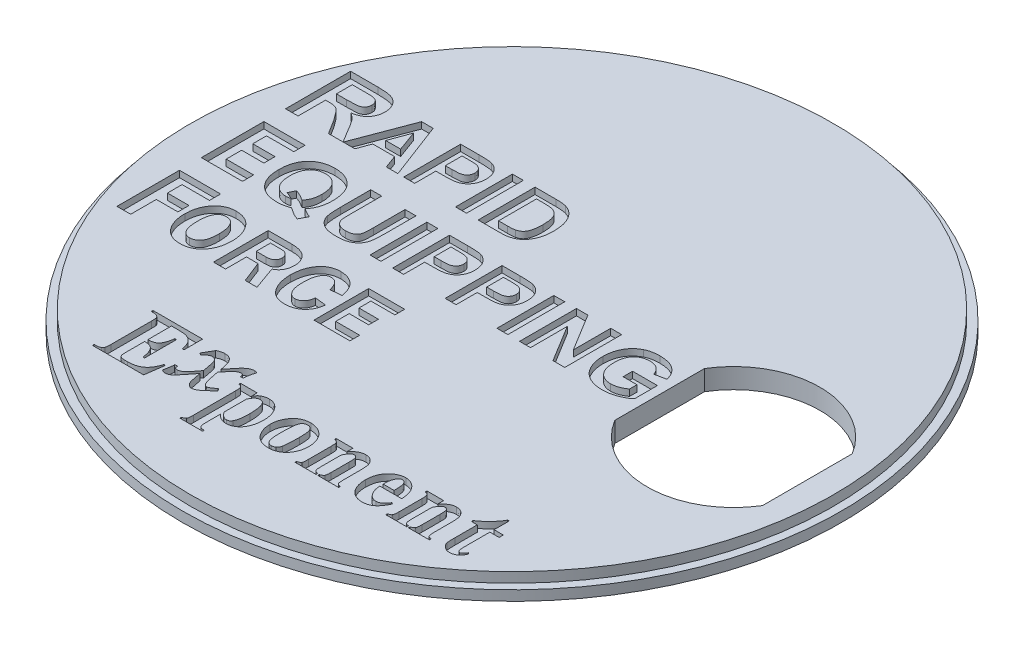
from build123d import *

# Parameters (mm, degrees)
SKETCH1_R           = 20.828
BOSS_EXTRUDE1_DEPTH = 1.27
CUT_EXTRUDE2_START  = -0.635
SKETCH2_R           = 20.828
SKETCH2_R_2         = 20.32
CUT_EXTRUDE2_DEPTH  = 0.635
CUT_EXTRUDE3_DEPTH  = 30.482606194
CUT_EXTRUDE4_DEPTH  = 0.508
SKETCH14_W          = 0.691470416
SKETCH14_H          = 3.595646159
SKETCH14_W_2        = 0.691470415
CUT_EXTRUDE5_DEPTH  = 0.4064


with BuildPart() as part:
    # Sketch1 → Boss-Extrude1 (new body)
    with BuildSketch(Plane(origin=(0, 0, 0), x_dir=(1, 0, 0), z_dir=(0, 1, 0))):
        with Locations(Location((0, 0, 0), (0, 0, 270))):
            Circle(SKETCH1_R)
    extrude(amount=BOSS_EXTRUDE1_DEPTH)

    # Sketch2 → Cut-Extrude2 (cut)
    with BuildSketch(Plane(origin=(0, 1.27, 0), x_dir=(1, 0, 0), z_dir=(0, 1, 0)).offset(CUT_EXTRUDE2_START)):
        with Locations(Location((0, 0, 0), (0, 0, 270))):
            Circle(SKETCH2_R)
        with Locations(Location((0, 0, 0), (0, 0, 270))):
            Circle(SKETCH2_R_2, mode=Mode.SUBTRACT)
    extrude(amount=CUT_EXTRUDE2_DEPTH, mode=Mode.SUBTRACT)

    # Sketch3 → Cut-Extrude3 (cut, through all)
    with BuildSketch(Plane(origin=(0, 1.27, 0), x_dir=(1, 0, 0), z_dir=(0, 1, 0))):
        with BuildLine():
            Line((18.66773, 2.835365662), (18.66773, -2.835365662))
            ThreePointArc((18.66773, -2.835365662), (14.00048, -5.461), (9.33323, -2.835365662))
            Line((9.33323, -2.835365662), (9.33323, 2.835365662))
            ThreePointArc((9.33323, 2.835365662), (14.00048, 5.461), (18.66773, 2.835365662))
        make_face()
    extrude(amount=-CUT_EXTRUDE3_DEPTH, mode=Mode.SUBTRACT)

    # Sketch12 → Cut-Extrude4 (cut)
    with BuildSketch(Plane.XZ):
        with BuildLine():
            Line((-7.6581, 18.2626), (5.6769, 18.2626))
            ThreePointArc((5.6769, 18.2626), (6.799432015, 17.797632015), (7.2644, 16.6751))
            Line((7.2644, 16.6751), (7.2644, 3.3401))
            ThreePointArc((7.2644, 3.3401), (6.799432015, 2.217567985), (5.6769, 1.7526))
            Line((5.6769, 1.7526), (-7.6581, 1.7526))
            ThreePointArc((-7.6581, 1.7526), (-8.780632015, 2.217567985), (-9.2456, 3.3401))
            Line((-9.2456, 3.3401), (-9.2456, 16.6751))
            ThreePointArc((-9.2456, 16.6751), (-8.780632015, 17.797632015), (-7.6581, 18.2626))
        make_face()
    extrude(amount=-CUT_EXTRUDE4_DEPTH, mode=Mode.SUBTRACT)

    # Sketch14 → Cut-Extrude5 (cut)
    # profile 1 of 27: a face of its own
    with BuildSketch(Plane(origin=(0, 1.27, 0), x_dir=(1, 0, 0), z_dir=(0, 1, 0))):
        with BuildLine():
            Line((-18.120532318, 3.81), (-18.120532318, 7.919309896))
            Line((-18.120532318, 7.919309896), (-16.395972176, 7.919309896))
            add(Edge.make_bspline(
                [(-16.395972176, 7.919309896), (-16.343561088, 7.918986888), (-16.242555331, 7.918364391), (-16.0964813, 7.913825025), (-15.961768254, 7.904314787), (-15.837818605, 7.893544366), (-15.725227691, 7.877874096), (-15.62355035, 7.859101267), (-15.532957761, 7.837346147), (-15.452128126, 7.811290862), (-15.378427918, 7.781469684), (-15.309772559, 7.745974091), (-15.245407162, 7.704386642), (-15.184343138, 7.658140741), (-15.126321905, 7.60716533), (-15.072934099, 7.550111348), (-15.02324956, 7.487828346), (-14.977308378, 7.420834523), (-14.936837073, 7.349425697), (-14.899856926, 7.275895178), (-14.869753691, 7.199460492), (-14.844888693, 7.120481703), (-14.825026149, 7.039130284), (-14.811239865, 6.95519941), (-14.802633237, 6.868840999), (-14.801864922, 6.810508396), (-14.801474326, 6.780853248)],
                knots=[0, 0, 0, 0, 1.675828044, 3.229627355, 4.67171229, 5.993455049, 7.206927059, 8.304770529, 9.29850117, 10.183580433, 11.017754134, 11.837875825, 12.650738409, 13.464925643, 14.285328857, 15.117007378, 15.959673368, 16.830859064, 17.711229498, 18.58228265, 19.460420693, 20.334473227, 21.228207035, 22.135446768, 23.052097822, 24, 24, 24, 24], degree=3))
            add(Edge.make_bspline(
                [(-14.801474326, 6.780853248), (-14.802198823, 6.743496062), (-14.80361469, 6.670489824), (-14.81664425, 6.563485399), (-14.835996475, 6.46125031), (-14.863582922, 6.363642918), (-14.901513724, 6.271811225), (-14.94554675, 6.184468801), (-14.998063531, 6.101911913), (-15.058707271, 6.024958986), (-15.12742368, 5.953541901), (-15.2045139, 5.889130366), (-15.28942753, 5.831472647), (-15.382678246, 5.780901233), (-15.483616739, 5.737668154), (-15.59268071, 5.701293158), (-15.709376427, 5.671687964), (-15.790549904, 5.657757835), (-15.832094516, 5.650628391)],
                knots=[0, 0, 0, 0, 1.05911256, 2.069797862, 3.05271628, 4.008392045, 4.940519534, 5.866323021, 6.779546087, 7.71056835, 8.640711998, 9.585328432, 10.554502533, 11.547017206, 12.589327225, 13.664782803, 14.804835066, 16, 16, 16, 16], degree=3))
            add(Edge.make_bspline(
                [(-15.832094516, 5.650628391), (-15.79191621, 5.624017921), (-15.713281792, 5.571937607), (-15.604485415, 5.486160676), (-15.506812082, 5.396131153), (-15.432858761, 5.316071301), (-15.376033256, 5.245667261), (-15.330279015, 5.184091209), (-15.280925731, 5.113226105), (-15.228457453, 5.033033552), (-15.171323084, 4.944223065), (-15.111647556, 4.845435263), (-15.048182072, 4.737633736), (-15.005511593, 4.662328911), (-14.983396899, 4.623300917)],
                knots=[0, 0, 0, 0, 1.285445069, 2.515791127, 3.691898215, 4.826622834, 5.420063933, 6.105349801, 6.873086501, 7.723915395, 8.66222816, 9.690593598, 10.803111229, 12, 12, 12, 12], degree=3))
            Line((-14.983396899, 4.623300917), (-14.485373564, 3.81))
            Line((-14.485373564, 3.81), (-15.408980476, 3.81))
            Line((-15.408980476, 3.81), (-15.993437613, 4.742661881))
            add(Edge.make_bspline(
                [(-15.993437613, 4.742661881), (-16.020279369, 4.780014317), (-16.071525799, 4.851327795), (-16.145503188, 4.952666561), (-16.213185933, 5.042876265), (-16.27277277, 5.123263541), (-16.32727877, 5.191549221), (-16.375048911, 5.248923288), (-16.415110179, 5.296616905), (-16.460439604, 5.343907185), (-16.513175577, 5.392508421), (-16.578458499, 5.439630086), (-16.645498003, 5.477194979), (-16.717325477, 5.505857876), (-16.80039178, 5.525843552), (-16.900250631, 5.538576968), (-17.020041826, 5.547971539), (-17.10662686, 5.548350126), (-17.153296916, 5.548554187)],
                knots=[0, 0, 0, 0, 1.465447777, 2.797841088, 3.997266218, 5.05856206, 5.985598736, 6.780315439, 7.437430484, 7.969193402, 8.866571936, 9.718200644, 10.52825214, 11.309096006, 12.174169268, 13.242355782, 14.513606761, 16, 16, 16, 16], degree=3))
            Line((-17.153296916, 5.548554187), (-17.330280415, 5.548554187))
            Line((-17.330280415, 5.548554187), (-17.330280415, 3.81))
            Line((-17.330280415, 3.81), (-18.120532318, 3.81))
        make_face()
        with BuildLine():
            Line((-17.330280415, 6.233439169), (-16.693962998, 6.233439169))
            add(Edge.make_bspline(
                [(-16.693962998, 6.233439169), (-16.644844275, 6.233544434), (-16.551264809, 6.23374498), (-16.418192946, 6.236649815), (-16.299314965, 6.239115317), (-16.195342259, 6.245309994), (-16.105809647, 6.251449504), (-16.03107629, 6.259428638), (-15.970512538, 6.268859718), (-15.910019529, 6.28352257), (-15.848054133, 6.309069696), (-15.782010746, 6.345456323), (-15.725565097, 6.392659646), (-15.676670129, 6.447231461), (-15.639370117, 6.511385592), (-15.610155386, 6.582263902), (-15.595342898, 6.661441367), (-15.592957045, 6.716321662), (-15.591726229, 6.744633369)],
                knots=[0, 0, 0, 0, 1.697953026, 3.23488743, 4.60134403, 5.807846676, 6.835100678, 7.703488618, 8.405232423, 8.952775585, 9.851109663, 10.713519226, 11.549115941, 12.382556273, 13.233359028, 14.101746968, 15.020727134, 16, 16, 16, 16], degree=3))
            add(Edge.make_bspline(
                [(-15.591726229, 6.744633369), (-15.593126051, 6.776305867), (-15.595826783, 6.837412844), (-15.617125137, 6.924368655), (-15.654300548, 7.001182141), (-15.705356496, 7.067980125), (-15.769449196, 7.124385306), (-15.84579069, 7.169158742), (-15.933813813, 7.20250414), (-15.997301774, 7.21481853), (-16.030480671, 7.221254048)],
                knots=[0, 0, 0, 0, 1.062977961, 2.050844577, 2.982300261, 3.90936959, 4.856017476, 5.831122378, 6.86654153, 8, 8, 8, 8], degree=3))
            add(Edge.make_bspline(
                [(-16.030480671, 7.221254048), (-16.041447989, 7.222459121), (-16.067442835, 7.225315396), (-16.113346652, 7.227149856), (-16.172040571, 7.22996962), (-16.244235023, 7.231121995), (-16.329285028, 7.233142007), (-16.427528781, 7.233512932), (-16.538654155, 7.234698012), (-16.617132476, 7.234519278), (-16.658566298, 7.234424913)],
                knots=[0, 0, 0, 0, 0.42127143, 0.998501726, 1.753681744, 2.66564073, 3.755712164, 5.002818897, 6.417592707, 8, 8, 8, 8], degree=3))
            Line((-16.658566298, 7.234424913), (-17.330280415, 7.234424913))
            Line((-17.330280415, 7.234424913), (-17.330280415, 6.233439169))
        make_face(mode=Mode.SUBTRACT)
    # profile 2 of 27: a face of its own
    with BuildSketch(Plane(origin=(0, 1.27, 0), x_dir=(1, 0, 0), z_dir=(0, 1, 0))):
        Polygon((-15.510164954, -1.524), (-18.108880708, -1.524), (-18.108880708, 2.428213542), (-15.510164954, 2.428213542), (-15.510164954, 1.724394692), (-17.242642123, 1.724394692), (-17.242642123, 0.858156107), (-15.835004424, 0.858156107), (-15.835004424, 0.154337257), (-17.242642123, 0.154337257), (-17.242642123, -0.82018115), (-15.510164954, -0.82018115), align=None)
    # profile 3 of 27: a face of its own
    with BuildSketch(Plane(origin=(0, 1.27, 0), x_dir=(1, 0, 0), z_dir=(0, 1, 0))):
        Polygon((-17.242642123, -6.858), (-18.108880708, -6.858), (-18.108880708, -2.905786458), (-15.510164954, -2.905786458), (-15.510164954, -3.609605308), (-17.242642123, -3.609605308), (-17.242642123, -4.532521613), (-15.878993102, -4.532521613), (-15.878993102, -5.236340462), (-17.242642123, -5.236340462), align=None)
    # profile 4 of 27: a face of its own
    with BuildSketch(Plane(origin=(0, 1.27, 0), x_dir=(1, 0, 0), z_dir=(0, 1, 0))):
        Polygon((-11.020647924, 3.81), (-11.753894677, 3.81), (-12.057133265, 4.639764498), (-13.437192969, 4.639764498), (-13.740431557, 3.81), (-14.478, 3.81), (-13.118828465, 7.405646159), (-12.386301994, 7.405646159), align=None)
        Polygon((-12.276819178, 5.239038858), (-12.749323962, 6.529783633), (-13.220388182, 5.239038858), align=None, mode=Mode.SUBTRACT)
    # profile 5 of 27: a face of its own
    with BuildSketch(Plane(origin=(0, 1.27, 0), x_dir=(1, 0, 0), z_dir=(0, 1, 0))):
        with BuildLine():
            Line((-10.651863703, 3.81), (-10.651863703, 7.405646159))
            Line((-10.651863703, 7.405646159), (-9.501573856, 7.405646159))
            add(Edge.make_bspline(
                [(-9.501573856, 7.405646159), (-9.449471778, 7.405589261), (-9.34982036, 7.405480437), (-9.207673639, 7.402456849), (-9.079691813, 7.398176626), (-8.966064828, 7.39284579), (-8.866392859, 7.384891159), (-8.781123023, 7.375679816), (-8.709718383, 7.365770856), (-8.667670306, 7.355516407), (-8.648760344, 7.350904751)],
                knots=[0, 0, 0, 0, 1.460485487, 2.793352117, 3.985295279, 5.050041172, 5.981765236, 6.787433016, 7.454681457, 8, 8, 8, 8], degree=3))
            add(Edge.make_bspline(
                [(-8.648760344, 7.350904751), (-8.623614692, 7.343734757), (-8.573706465, 7.329503998), (-8.502203539, 7.29916628), (-8.43328604, 7.264006485), (-8.367819844, 7.222102363), (-8.30558241, 7.174197862), (-8.24638874, 7.12068365), (-8.189923163, 7.061318151), (-8.136966807, 6.996218638), (-8.088465015, 6.925713378), (-8.046547281, 6.84969813), (-8.011428984, 6.768503295), (-7.981508778, 6.682739042), (-7.959433508, 6.59148584), (-7.943984832, 6.495377725), (-7.933230626, 6.394372663), (-7.932469195, 6.325253036), (-7.93208007, 6.289929833)],
                knots=[0, 0, 0, 0, 0.907145743, 1.80047177, 2.69161667, 3.591261238, 4.495029544, 5.415863088, 6.359363025, 7.337192411, 8.326890979, 9.326929023, 10.346104993, 11.395420813, 12.477187422, 13.601053412, 14.774031606, 16, 16, 16, 16], degree=3))
            add(Edge.make_bspline(
                [(-7.93208007, 6.289929833), (-7.933189853, 6.236287533), (-7.935326246, 6.13302316), (-7.959228692, 5.984981165), (-7.995685803, 5.849754346), (-8.048970505, 5.728645219), (-8.113935625, 5.621178529), (-8.185496043, 5.524297817), (-8.267207524, 5.440923164), (-8.355489571, 5.369709056), (-8.44878756, 5.311430384), (-8.542254438, 5.261748644), (-8.637151402, 5.223551735), (-8.701851941, 5.206909035), (-8.733753582, 5.198703084)],
                knots=[0, 0, 0, 0, 1.312386234, 2.526415563, 3.661883817, 4.733421185, 5.753802465, 6.732107337, 7.675884281, 8.604170108, 9.50284679, 10.365392406, 11.194030444, 12, 12, 12, 12], degree=3))
            add(Edge.make_bspline(
                [(-8.733753582, 5.198703084), (-8.756523409, 5.194371728), (-8.804519487, 5.185241746), (-8.880638396, 5.176140815), (-8.963840489, 5.166067078), (-9.054467981, 5.15949642), (-9.152411238, 5.153343274), (-9.257632227, 5.150438171), (-9.369980576, 5.146938112), (-9.447309168, 5.14687522), (-9.487168222, 5.146842803)],
                knots=[0, 0, 0, 0, 0.735353946, 1.55003838, 2.431865514, 3.394945452, 4.432993119, 5.54609699, 6.735134699, 8, 8, 8, 8], degree=3))
            Line((-9.487168222, 5.146842803), (-9.960393288, 5.146842803))
            Line((-9.960393288, 5.146842803), (-9.960393288, 3.81))
            Line((-9.960393288, 3.81), (-10.651863703, 3.81))
        make_face()
        with BuildLine():
            Line((-9.960393288, 6.806371799), (-9.960393288, 5.746117162))
            Line((-9.960393288, 5.746117162), (-9.545511038, 5.746117162))
            add(Edge.make_bspline(
                [(-9.545511038, 5.746117162), (-9.509733906, 5.746163491), (-9.44128775, 5.746252123), (-9.3430827, 5.749433492), (-9.254187396, 5.753316942), (-9.174416093, 5.759744847), (-9.104250314, 5.768216673), (-9.043220174, 5.778350043), (-8.991254544, 5.789224208), (-8.93506079, 5.807244442), (-8.874978432, 5.836399537), (-8.810817535, 5.878302731), (-8.754452263, 5.928402942), (-8.707548885, 5.987243906), (-8.670083471, 6.052619625), (-8.643258207, 6.123860108), (-8.625937159, 6.199784651), (-8.62435504, 6.252379551), (-8.623550485, 6.279125607)],
                knots=[0, 0, 0, 0, 1.411705958, 2.700771114, 3.876961699, 4.922619712, 5.858038221, 6.66485904, 7.363650596, 7.950905807, 8.989198271, 9.987739806, 10.967313358, 11.951275539, 12.944273208, 13.927870418, 14.946261014, 16, 16, 16, 16], degree=3))
            add(Edge.make_bspline(
                [(-8.623550485, 6.279125607), (-8.624682807, 6.311701887), (-8.626878231, 6.374862998), (-8.651087625, 6.464814962), (-8.688439954, 6.546447459), (-8.74184318, 6.617220535), (-8.80635302, 6.676734872), (-8.878859388, 6.726252916), (-8.96091069, 6.76090602), (-9.018981019, 6.774332818), (-9.048516678, 6.78116194)],
                knots=[0, 0, 0, 0, 1.085904563, 2.105425768, 3.088705091, 4.068969419, 5.045188284, 6.010769642, 6.988240112, 8, 8, 8, 8], degree=3))
            add(Edge.make_bspline(
                [(-9.048516678, 6.78116194), (-9.061226546, 6.78319478), (-9.089438515, 6.787707054), (-9.136332547, 6.792416174), (-9.191808195, 6.796699113), (-9.255932329, 6.800215534), (-9.328450777, 6.802964561), (-9.409602737, 6.805373387), (-9.49917448, 6.805566904), (-9.56183801, 6.806096067), (-9.594490193, 6.806371799)],
                knots=[0, 0, 0, 0, 0.564603001, 1.253243608, 2.066786758, 3.005752288, 4.070476343, 5.250658742, 6.567396469, 8, 8, 8, 8], degree=3))
            Line((-9.594490193, 6.806371799), (-9.960393288, 6.806371799))
        make_face(mode=Mode.SUBTRACT)
    # profile 6 of 27: a face of its own
    with BuildSketch(Plane(origin=(0, 1.27, 0), x_dir=(1, 0, 0), z_dir=(0, 1, 0))):
        with Locations((-7.03316853, 5.60782308)):
            Rectangle(SKETCH14_W, SKETCH14_H)
    # profile 7 of 27: a face of its own
    with BuildSketch(Plane(origin=(0, 1.27, 0), x_dir=(1, 0, 0), z_dir=(0, 1, 0))):
        with BuildLine():
            Line((-5.94986488, 7.405646159), (-4.631029119, 7.405646159))
            add(Edge.make_bspline(
                [(-4.631029119, 7.405646159), (-4.595009573, 7.405664832), (-4.524871151, 7.405701192), (-4.423081937, 7.401478418), (-4.327895936, 7.397230863), (-4.239586354, 7.388728187), (-4.15784682, 7.379815874), (-4.082530653, 7.368532215), (-4.014113631, 7.354070972), (-3.970969896, 7.342666552), (-3.950362929, 7.337219399)],
                knots=[0, 0, 0, 0, 1.259756885, 2.453039283, 3.563158368, 4.591894114, 5.55549294, 6.43918076, 7.254497783, 8, 8, 8, 8], degree=3))
            add(Edge.make_bspline(
                [(-3.950362929, 7.337219399), (-3.924592658, 7.328820466), (-3.873516299, 7.312173883), (-3.798636786, 7.283006299), (-3.727692346, 7.246832613), (-3.658051025, 7.208807339), (-3.59282181, 7.163846876), (-3.528552644, 7.117071532), (-3.469414492, 7.062887189), (-3.39186241, 6.987161003), (-3.303369591, 6.88167203), (-3.210659878, 6.741746208), (-3.132190332, 6.588158368), (-3.078576331, 6.45054901), (-3.042374076, 6.333569433), (-3.018709057, 6.239781473), (-2.998607063, 6.14098782), (-2.982103263, 6.037163566), (-2.969280286, 5.928308699), (-2.959733443, 5.814452232), (-2.955083167, 5.695495808), (-2.954030269, 5.614548699), (-2.953493081, 5.573249559)],
                knots=[0, 0, 0, 0, 0.745524535, 1.477620414, 2.207090574, 2.934465325, 3.657932502, 4.384347339, 5.118673636, 5.861150177, 7.365375624, 8.894729774, 10.468936425, 12.099947606, 12.950091786, 13.83580991, 14.759228729, 15.722225242, 16.726454549, 17.773376212, 18.863978586, 20, 20, 20, 20], degree=3))
            add(Edge.make_bspline(
                [(-2.953493081, 5.573249559), (-2.954473695, 5.501871968), (-2.956370185, 5.363829139), (-2.978341135, 5.164633915), (-3.010004049, 4.979617697), (-3.045694721, 4.864196537), (-3.062975896, 4.808310412)],
                knots=[0, 0, 0, 0, 1.103207939, 2.133582005, 3.096293362, 4, 4, 4, 4], degree=3))
            add(Edge.make_bspline(
                [(-3.062975896, 4.808310412), (-3.074387198, 4.776241735), (-3.096835009, 4.713157645), (-3.136116995, 4.622158536), (-3.178561459, 4.535559424), (-3.224520459, 4.45342854), (-3.274226195, 4.376135309), (-3.327864583, 4.303910922), (-3.384604187, 4.235804521), (-3.425708747, 4.193884709), (-3.446165751, 4.173021968)],
                knots=[0, 0, 0, 0, 1.090884612, 2.145940218, 3.175104604, 4.181306866, 5.161203701, 6.118658341, 7.063689906, 8, 8, 8, 8], degree=3))
            add(Edge.make_bspline(
                [(-3.446165751, 4.173021968), (-3.479270127, 4.143250943), (-3.547536068, 4.081858845), (-3.667832348, 4.005883671), (-3.803800971, 3.938749919), (-3.902152359, 3.904264424), (-3.953244056, 3.886349858)],
                knots=[0, 0, 0, 0, 0.908140292, 1.872714733, 2.8949153, 4, 4, 4, 4], degree=3))
            add(Edge.make_bspline(
                [(-3.953244056, 3.886349858), (-3.973811057, 3.88003312), (-4.016496803, 3.866923056), (-4.084179263, 3.852921236), (-4.156431987, 3.838170181), (-4.234088149, 3.829283918), (-4.316341641, 3.81991296), (-4.403847947, 3.814651691), (-4.496303728, 3.810916496), (-4.559716882, 3.810310028), (-4.592133908, 3.81)],
                knots=[0, 0, 0, 0, 0.799129865, 1.658552685, 2.566799617, 3.538529252, 4.561352959, 5.643373779, 6.795284424, 8, 8, 8, 8], degree=3))
            Line((-4.592133908, 3.81), (-5.94986488, 3.81))
            Line((-5.94986488, 3.81), (-5.94986488, 7.405646159))
        make_face()
        with BuildLine():
            Line((-5.258394464, 6.806371799), (-5.258394464, 4.40927436))
            Line((-5.258394464, 4.40927436), (-4.689371935, 4.40927436))
            add(Edge.make_bspline(
                [(-4.689371935, 4.40927436), (-4.66368206, 4.409478098), (-4.614219236, 4.409870372), (-4.542645263, 4.411023022), (-4.476869383, 4.414143463), (-4.416547023, 4.417375731), (-4.361835226, 4.422716003), (-4.31249593, 4.427968365), (-4.268803784, 4.435316309), (-4.241818441, 4.441116679), (-4.22911194, 4.443847881)],
                knots=[0, 0, 0, 0, 1.333384787, 2.567275092, 3.714769766, 4.750907381, 5.701951617, 6.567520054, 7.325492842, 8, 8, 8, 8], degree=3))
            add(Edge.make_bspline(
                [(-4.22911194, 4.443847881), (-4.199351876, 4.451789342), (-4.141387119, 4.467257215), (-4.059998742, 4.501739554), (-3.986352745, 4.543338724), (-3.919215786, 4.593359938), (-3.858711488, 4.656575183), (-3.807063673, 4.737422523), (-3.759264982, 4.833844383), (-3.726532427, 4.926144217), (-3.703037062, 5.008584269), (-3.687132627, 5.07777824), (-3.674563783, 5.15263912), (-3.663752937, 5.232871459), (-3.655017517, 5.318372083), (-3.649581925, 5.40944975), (-3.6458721, 5.50599297), (-3.645272101, 5.572285412), (-3.644963496, 5.606382516)],
                knots=[0, 0, 0, 0, 1.038686998, 2.023088296, 2.974059649, 3.888265163, 4.839857954, 5.909819677, 7.113156087, 8.466843969, 9.20827164, 10.006482943, 10.861893492, 11.769681931, 12.739021491, 13.762258324, 14.849031541, 16, 16, 16, 16], degree=3))
            add(Edge.make_bspline(
                [(-3.644963496, 5.606382516), (-3.645269728, 5.640479725), (-3.645862957, 5.706532441), (-3.649567092, 5.80235579), (-3.654972152, 5.891999237), (-3.663769783, 5.975573595), (-3.674413043, 6.05319437), (-3.687129111, 6.124927247), (-3.702937671, 6.190301466), (-3.726453021, 6.267967245), (-3.762101079, 6.355265993), (-3.81061113, 6.450713723), (-3.870183142, 6.532066511), (-3.936004415, 6.602739008), (-4.011897455, 6.660898901), (-4.095910866, 6.7096112), (-4.189873861, 6.747419772), (-4.256712691, 6.763523683), (-4.291056165, 6.771798278)],
                knots=[0, 0, 0, 0, 1.117996097, 2.165769068, 3.143980016, 4.062055362, 4.920439205, 5.712587309, 6.449616741, 7.124491204, 8.371470382, 9.537068822, 10.625202851, 11.666538334, 12.693249444, 13.747832046, 14.842779399, 16, 16, 16, 16], degree=3))
            add(Edge.make_bspline(
                [(-4.291056165, 6.771798278), (-4.305921694, 6.774560502), (-4.338649898, 6.78064186), (-4.392959202, 6.787744922), (-4.456676118, 6.793016001), (-4.530125462, 6.79839731), (-4.61300983, 6.801468791), (-4.70567603, 6.804674381), (-4.807736299, 6.805769405), (-4.879046367, 6.806165231), (-4.916260665, 6.806371799)],
                knots=[0, 0, 0, 0, 0.578738571, 1.274160813, 2.095454135, 3.025967819, 4.093109015, 5.270126069, 6.575371698, 8, 8, 8, 8], degree=3))
            Line((-4.916260665, 6.806371799), (-5.258394464, 6.806371799))
        make_face(mode=Mode.SUBTRACT)
    # profile 8 of 27: a face of its own
    with BuildSketch(Plane(origin=(0, 1.27, 0), x_dir=(1, 0, 0), z_dir=(0, 1, 0))):
        with BuildLine():
            add(Edge.make_bspline(
                [(-12.034026231, -1.039250428), (-11.989568281, -1.069723387), (-11.900479635, -1.130787712), (-11.75877604, -1.209782143), (-11.612567844, -1.281595972), (-11.510956801, -1.320222547), (-11.45996173, -1.339607889)],
                knots=[0, 0, 0, 0, 0.994855506, 1.99357661, 2.993045438, 4, 4, 4, 4], degree=3))
            Line((-11.45996173, -1.339607889), (-11.724305108, -1.846686194))
            add(Edge.make_bspline(
                [(-11.724305108, -1.846686194), (-11.778346951, -1.829957478), (-11.887289781, -1.796234098), (-11.990125819, -1.746925959), (-12.04194933, -1.722077463)],
                knots=[0, 0, 0, 0, 0.992113803, 2, 2, 2, 2], degree=3))
            add(Edge.make_bspline(
                [(-12.04194933, -1.722077463), (-12.047034735, -1.719511671), (-12.061761386, -1.712081483), (-12.088510311, -1.693790127), (-12.129322669, -1.669136503), (-12.182449286, -1.634988101), (-12.248424784, -1.592661044), (-12.327462622, -1.542200997), (-12.418472793, -1.482181226), (-12.483923851, -1.439908214), (-12.518775804, -1.417398311)],
                knots=[0, 0, 0, 0, 0.241377655, 0.698997227, 1.371388316, 2.263975901, 3.376788369, 4.695767198, 6.240533187, 8, 8, 8, 8], degree=3))
            add(Edge.make_bspline(
                [(-12.518775804, -1.417398311), (-12.547680075, -1.429776705), (-12.605768032, -1.454653152), (-12.695894004, -1.485285081), (-12.788311827, -1.511089437), (-12.882693164, -1.532973206), (-12.979437484, -1.549233495), (-13.078408024, -1.56170326), (-13.179882223, -1.56901621), (-13.248409578, -1.569735174), (-13.282994669, -1.570098028)],
                knots=[0, 0, 0, 0, 0.961025642, 1.931341354, 2.907359807, 3.893838693, 4.891829695, 5.905170566, 6.942759923, 8, 8, 8, 8], degree=3))
            add(Edge.make_bspline(
                [(-13.282994669, -1.570098028), (-13.348598044, -1.56850132), (-13.476833928, -1.565380213), (-13.663818246, -1.543260083), (-13.839512668, -1.504919766), (-14.004688365, -1.452549912), (-14.158352437, -1.383801154), (-14.301852876, -1.300699626), (-14.433202912, -1.201089253), (-14.554212303, -1.08802292), (-14.661270805, -0.960227815), (-14.754993016, -0.819934694), (-14.83438846, -0.667608616), (-14.898408096, -0.502447414), (-14.949004246, -0.325786575), (-14.983500293, -0.136378986), (-15.00570227, 0.06465203), (-15.008219445, 0.202933701), (-15.009509862, 0.273823079)],
                knots=[0, 0, 0, 0, 1.098101164, 2.146474535, 3.146072545, 4.104420533, 5.041773038, 5.958565538, 6.874115049, 7.795336865, 8.725215067, 9.658214839, 10.614563411, 11.594512188, 12.618591104, 13.685899083, 14.813688224, 16, 16, 16, 16], degree=3))
            add(Edge.make_bspline(
                [(-15.009509862, 0.273823079), (-15.008216518, 0.344709565), (-15.005702345, 0.482508056), (-14.983651989, 0.683151764), (-14.948005606, 0.871882639), (-14.897925362, 1.048824191), (-14.832946866, 1.213511548), (-14.753241039, 1.365852473), (-14.659371481, 1.506441605), (-14.551043873, 1.633954937), (-14.430676032, 1.748178324), (-14.298944391, 1.847048335), (-14.157380556, 1.931464151), (-14.005421654, 2.000147981), (-13.842648196, 2.052488977), (-13.670299582, 2.090707234), (-13.487421687, 2.113097834), (-13.362287648, 2.116169221), (-13.298120584, 2.117744187)],
                knots=[0, 0, 0, 0, 1.193283781, 2.319662245, 3.393996131, 4.424093603, 5.411284417, 6.369670503, 7.313761776, 8.251713527, 9.181123148, 10.102053383, 11.01932051, 11.951118596, 12.903560284, 13.893239571, 14.919681386, 16, 16, 16, 16], degree=3))
            add(Edge.make_bspline(
                [(-13.298120584, 2.117744187), (-13.234414399, 2.116586151), (-13.110160793, 2.1143275), (-12.92898156, 2.090170704), (-12.757783303, 2.053518887), (-12.596362379, 2.000685257), (-12.445545847, 1.932071012), (-12.304548818, 1.848764749), (-12.174193596, 1.750062752), (-12.054443286, 1.636929322), (-11.947338775, 1.50985595), (-11.852459129, 1.370932604), (-11.774560933, 1.218446666), (-11.708936521, 1.054985263), (-11.660016942, 0.878954169), (-11.623904349, 0.691362549), (-11.602159589, 0.491619336), (-11.599578962, 0.354309206), (-11.598255813, 0.283907023)],
                knots=[0, 0, 0, 0, 1.078752742, 2.104017338, 3.091035458, 4.041673215, 4.975566109, 5.892967701, 6.810684895, 7.740128604, 8.678185021, 9.621404646, 10.583875016, 11.573429805, 12.6009998, 13.674031063, 14.80742018, 16, 16, 16, 16], degree=3))
            add(Edge.make_bspline(
                [(-11.598255813, 0.283907023), (-11.599683106, 0.209646822), (-11.602457721, 0.065287205), (-11.626605067, -0.144355538), (-11.665748724, -0.340690551), (-11.70607574, -0.464069588), (-11.725745671, -0.524249025)],
                knots=[0, 0, 0, 0, 1.083667057, 2.106616435, 3.076482036, 4, 4, 4, 4], degree=3))
            add(Edge.make_bspline(
                [(-11.725745671, -0.524249025), (-11.743378062, -0.568576123), (-11.779247971, -0.658751582), (-11.850149639, -0.788914314), (-11.934508309, -0.917330055), (-12.000383338, -0.998034192), (-12.034026231, -1.039250428)],
                knots=[0, 0, 0, 0, 0.948216854, 1.928975575, 2.942311585, 4, 4, 4, 4], degree=3))
        make_face()
        with BuildLine():
            add(Edge.make_bspline(
                [(-12.610971859, -0.669025643), (-12.584974234, -0.640603475), (-12.532916765, -0.583691115), (-12.468542697, -0.486210412), (-12.412339474, -0.381673648), (-12.36815133, -0.267472759), (-12.332612626, -0.145346775), (-12.307809611, -0.014387708), (-12.292405091, 0.125075233), (-12.290635406, 0.220960517), (-12.289726229, 0.270221671)],
                knots=[0, 0, 0, 0, 0.906820982, 1.815812261, 2.745108282, 3.70056618, 4.696560745, 5.740060838, 6.83895416, 8, 8, 8, 8], degree=3))
            add(Edge.make_bspline(
                [(-12.289726229, 0.270221671), (-12.29052362, 0.320906511), (-12.292068293, 0.41909114), (-12.304862608, 0.561669326), (-12.327377447, 0.694200493), (-12.356761992, 0.817237461), (-12.396797925, 0.929784407), (-12.445081043, 1.032689656), (-12.501687306, 1.126206403), (-12.568007752, 1.20879173), (-12.640954024, 1.281395981), (-12.718932594, 1.345534156), (-12.803082618, 1.399221773), (-12.892975507, 1.442410133), (-12.987859007, 1.476392929), (-13.087957923, 1.501063663), (-13.193498043, 1.515500819), (-13.26566355, 1.517467513), (-13.302442274, 1.518469827)],
                knots=[0, 0, 0, 0, 1.335693338, 2.587451293, 3.768164612, 4.876224393, 5.916940853, 6.910477009, 7.867661778, 8.790666633, 9.694493319, 10.576027549, 11.446684429, 12.318352473, 13.199023277, 14.098364444, 15.030842682, 16, 16, 16, 16], degree=3))
            add(Edge.make_bspline(
                [(-13.302442274, 1.518469827), (-13.339467232, 1.517500039), (-13.411885042, 1.515603212), (-13.517529026, 1.500815974), (-13.617856369, 1.477333597), (-13.71262145, 1.443082351), (-13.802680988, 1.399812061), (-13.887145435, 1.346223889), (-13.966003021, 1.283092825), (-14.039316662, 1.210946994), (-14.104796413, 1.128335527), (-14.16300274, 1.036447154), (-14.211121228, 0.934224261), (-14.249762053, 0.822240411), (-14.280642337, 0.70107109), (-14.302879793, 0.570066056), (-14.315690814, 0.429422101), (-14.317240889, 0.332432776), (-14.318039446, 0.28246646)],
                knots=[0, 0, 0, 0, 0.980107447, 1.917010591, 2.819119613, 3.703969481, 4.579773866, 5.459928929, 6.346604172, 7.250235365, 8.177620171, 9.131899985, 10.124404622, 11.161948974, 12.264485933, 13.431998172, 14.677033863, 16, 16, 16, 16], degree=3))
            add(Edge.make_bspline(
                [(-14.318039446, 0.28246646), (-14.317260543, 0.231777312), (-14.315748008, 0.133345194), (-14.302658057, -0.009372552), (-14.281436844, -0.142343147), (-14.251228065, -0.265511554), (-14.212604908, -0.379018482), (-14.165031575, -0.482705757), (-14.108760281, -0.576443716), (-14.043609897, -0.65938184), (-13.97193829, -0.732347286), (-13.895354127, -0.795957338), (-13.814479023, -0.850448323), (-13.728935711, -0.894722134), (-13.638701249, -0.928723168), (-13.544090302, -0.953262357), (-13.444552279, -0.96788897), (-13.376680322, -0.96983233), (-13.342057767, -0.970823668)],
                knots=[0, 0, 0, 0, 1.356840463, 2.634818045, 3.833173645, 4.958776583, 6.025986406, 7.038359119, 8.007356852, 8.946032033, 9.855123386, 10.740685277, 11.607120956, 12.460971081, 13.313368256, 14.183325659, 15.073285775, 16, 16, 16, 16], degree=3))
            add(Edge.make_bspline(
                [(-13.342057767, -0.970823668), (-13.316092821, -0.970368109), (-13.264947279, -0.969470752), (-13.189385436, -0.959383696), (-13.115780331, -0.944801598), (-13.068239539, -0.929953683), (-13.044581432, -0.922564795)],
                knots=[0, 0, 0, 0, 1.028828871, 2.026578908, 3.017950568, 4, 4, 4, 4], degree=3))
            add(Edge.make_bspline(
                [(-13.044581432, -0.922564795), (-13.080852517, -0.903612698), (-13.152678638, -0.866082647), (-13.263725314, -0.818262522), (-13.374993871, -0.77517769), (-13.450670101, -0.751900416), (-13.488274948, -0.740333529)],
                knots=[0, 0, 0, 0, 1.021704821, 2.023239566, 3.017713044, 4, 4, 4, 4], degree=3))
            Line((-13.488274948, -0.740333529), (-13.287316359, -0.32545128))
            add(Edge.make_bspline(
                [(-13.287316359, -0.32545128), (-13.228548424, -0.345759773), (-13.110445337, -0.386572771), (-12.939840175, -0.46761336), (-12.7716125, -0.559848809), (-12.664921424, -0.632359687), (-12.610971859, -0.669025643)],
                knots=[0, 0, 0, 0, 0.979271047, 1.967993817, 2.972492781, 4, 4, 4, 4], degree=3))
        make_face(mode=Mode.SUBTRACT)
    # profile 9 of 27: a face of its own
    with BuildSketch(Plane(origin=(0, 1.27, 0), x_dir=(1, 0, 0), z_dir=(0, 1, 0))):
        with BuildLine():
            Line((-10.998981454, 2.071646159), (-10.307511038, 2.071646159))
            Line((-10.307511038, 2.071646159), (-10.307511038, 0.120403081))
            add(Edge.make_bspline(
                [(-10.307511038, 0.120403081), (-10.307247061, 0.083428662), (-10.306743102, 0.012840987), (-10.306396199, -0.088007061), (-10.304476395, -0.17855301), (-10.300313113, -0.258942762), (-10.297455737, -0.329135318), (-10.2921499, -0.389143562), (-10.286856923, -0.438944123), (-10.281710877, -0.468565909), (-10.279420053, -0.481752405)],
                knots=[0, 0, 0, 0, 1.470600056, 2.807515117, 4.011048972, 5.072079398, 6.00911328, 6.804506435, 7.467811572, 8, 8, 8, 8], degree=3))
            add(Edge.make_bspline(
                [(-10.279420053, -0.481752405), (-10.269975552, -0.517301273), (-10.251378137, -0.587301481), (-10.200116822, -0.682989906), (-10.132401349, -0.767333228), (-10.063329071, -0.827483593), (-10.000847873, -0.870053558), (-9.947775216, -0.895962253), (-9.891465473, -0.919579694), (-9.830728227, -0.937701156), (-9.766215347, -0.953558088), (-9.697147584, -0.962726677), (-9.624107831, -0.969763341), (-9.574043731, -0.970463905), (-9.548334145, -0.970823668)],
                knots=[0, 0, 0, 0, 1.376921055, 2.711331395, 4.038631339, 5.418057255, 6.132954575, 6.870556231, 7.630397752, 8.422890386, 9.247036838, 10.121396817, 11.035274583, 12, 12, 12, 12], degree=3))
            add(Edge.make_bspline(
                [(-9.548334145, -0.970823668), (-9.522395984, -0.970353231), (-9.471894914, -0.969437299), (-9.398710242, -0.963982607), (-9.330430195, -0.953691485), (-9.267096541, -0.940197835), (-9.208374775, -0.923144124), (-9.154733369, -0.90155212), (-9.106256855, -0.875568101), (-9.049297683, -0.836403765), (-8.988009687, -0.78115563), (-8.929027817, -0.706038734), (-8.886814953, -0.623117853), (-8.867015331, -0.547404885), (-8.85683899, -0.481438502), (-8.850639016, -0.423715626), (-8.844968826, -0.358393358), (-8.83981986, -0.285650617), (-8.836298628, -0.205432799), (-8.834394055, -0.117537029), (-8.832895146, -0.021977325), (-8.832551957, 0.044292669), (-8.832374153, 0.078626743)],
                knots=[0, 0, 0, 0, 1.036876239, 2.018776863, 2.930845756, 3.794842666, 4.605604932, 5.371924355, 6.101864688, 6.799283669, 8.1310906, 9.382718023, 10.597336334, 11.822035891, 12.492591141, 13.265194674, 14.141890321, 15.11351293, 16.179860579, 17.351049011, 18.627594861, 20, 20, 20, 20], degree=3))
            Line((-8.832374153, 0.078626743), (-8.832374153, 2.071646159))
            Line((-8.832374153, 2.071646159), (-8.140903738, 2.071646159))
            Line((-8.140903738, 2.071646159), (-8.140903738, 0.190990686))
            add(Edge.make_bspline(
                [(-8.140903738, 0.190990686), (-8.140992365, 0.139129886), (-8.14116266, 0.039480783), (-8.143821575, -0.103889413), (-8.149472613, -0.235425557), (-8.154204869, -0.355353123), (-8.163333198, -0.463366162), (-8.172890527, -0.559531833), (-8.185202543, -0.643833329), (-8.202759592, -0.73965423), (-8.232265355, -0.847159116), (-8.2798185, -0.965912049), (-8.340592848, -1.073951799), (-8.414346227, -1.171692902), (-8.500653757, -1.259523833), (-8.600807711, -1.337099299), (-8.713778211, -1.405362399), (-8.817302626, -1.454516097), (-8.907562653, -1.487614587), (-8.981077936, -1.510014161), (-9.059756145, -1.52866832), (-9.143505005, -1.543472055), (-9.232360502, -1.555953793), (-9.326354897, -1.564289549), (-9.425345987, -1.569491649), (-9.492865562, -1.569892652), (-9.527445976, -1.570098028)],
                knots=[0, 0, 0, 0, 1.415574045, 2.719986624, 3.913607924, 5.00929969, 5.995467356, 6.871900228, 7.64671288, 8.320227872, 9.530145585, 10.682614022, 11.803571353, 12.90325401, 14.015460715, 15.154679255, 16.351678057, 17.612271512, 18.275764165, 18.974412946, 19.708786676, 20.481351116, 21.295095879, 22.157200529, 23.056203067, 24, 24, 24, 24], degree=3))
            add(Edge.make_bspline(
                [(-9.527445976, -1.570098028), (-9.568985131, -1.569567049), (-9.649452665, -1.568538465), (-9.766257981, -1.563950039), (-9.875090811, -1.554479353), (-9.976293088, -1.541678834), (-10.069823027, -1.525223348), (-10.155917237, -1.505550917), (-10.233888382, -1.480687741), (-10.326758272, -1.445177114), (-10.430277257, -1.390857759), (-10.542962051, -1.318396181), (-10.641879923, -1.236610425), (-10.726161729, -1.14629964), (-10.796618038, -1.050637552), (-10.853886569, -0.951694183), (-10.899779685, -0.851118694), (-10.918956434, -0.781216761), (-10.928393849, -0.746816065)],
                knots=[0, 0, 0, 0, 1.128613534, 2.186292659, 3.174878439, 4.095586888, 4.95671962, 5.754129884, 6.492676435, 7.178284149, 8.453103036, 9.659838108, 10.813193309, 11.929983019, 13.007587775, 14.033493319, 15.032227051, 16, 16, 16, 16], degree=3))
            add(Edge.make_bspline(
                [(-10.928393849, -0.746816065), (-10.934169879, -0.719732776), (-10.946336046, -0.66268671), (-10.960153434, -0.571994647), (-10.972758964, -0.472127496), (-10.981368705, -0.362967133), (-10.989529951, -0.244859901), (-10.995389437, -0.11758311), (-10.997798863, 0.018834341), (-10.998579315, 0.112959779), (-10.998981454, 0.161459137)],
                knots=[0, 0, 0, 0, 0.728071598, 1.533551606, 2.411422299, 3.374601532, 4.412367648, 5.524718474, 6.72457895, 8, 8, 8, 8], degree=3))
            Line((-10.998981454, 0.161459137), (-10.998981454, 2.071646159))
        make_face()
    # profile 10 of 27: a face of its own
    with BuildSketch(Plane(origin=(0, 1.27, 0), x_dir=(1, 0, 0), z_dir=(0, 1, 0))):
        with Locations((-7.103698115, 0.27382308)):
            Rectangle(SKETCH14_W_2, SKETCH14_H)
    # profile 11 of 27: a face of its own
    with BuildSketch(Plane(origin=(0, 1.27, 0), x_dir=(1, 0, 0), z_dir=(0, 1, 0))):
        with BuildLine():
            Line((-6.020394464, -1.524), (-6.020394464, 2.071646159))
            Line((-6.020394464, 2.071646159), (-4.870104618, 2.071646159))
            add(Edge.make_bspline(
                [(-4.870104618, 2.071646159), (-4.81800254, 2.071589261), (-4.718351121, 2.071480437), (-4.576204401, 2.068456849), (-4.448222575, 2.064176626), (-4.334595589, 2.05884579), (-4.23492362, 2.050891159), (-4.149653785, 2.041679816), (-4.078249145, 2.031770856), (-4.036201068, 2.021516407), (-4.017291106, 2.016904751)],
                knots=[0, 0, 0, 0, 1.460485487, 2.793352117, 3.985295279, 5.050041172, 5.981765236, 6.787433016, 7.454681457, 8, 8, 8, 8], degree=3))
            add(Edge.make_bspline(
                [(-4.017291106, 2.016904751), (-3.992145454, 2.009734757), (-3.942237227, 1.995503998), (-3.8707343, 1.96516628), (-3.801816802, 1.930006485), (-3.736350606, 1.888102363), (-3.674113172, 1.840197862), (-3.614919502, 1.78668365), (-3.558453925, 1.727318151), (-3.505497569, 1.662218638), (-3.456995777, 1.591713378), (-3.415078042, 1.51569813), (-3.379959745, 1.434503295), (-3.35003954, 1.348739042), (-3.327964269, 1.25748584), (-3.312515594, 1.161377725), (-3.301761388, 1.060372663), (-3.300999957, 0.991253036), (-3.300610831, 0.955929833)],
                knots=[0, 0, 0, 0, 0.907145743, 1.80047177, 2.69161667, 3.591261238, 4.495029544, 5.415863088, 6.359363025, 7.337192411, 8.326890979, 9.326929023, 10.346104993, 11.395420813, 12.477187422, 13.601053412, 14.774031606, 16, 16, 16, 16], degree=3))
            add(Edge.make_bspline(
                [(-3.300610831, 0.955929833), (-3.301720614, 0.902287533), (-3.303857007, 0.79902316), (-3.327759454, 0.650981165), (-3.364216565, 0.515754346), (-3.417501266, 0.394645219), (-3.482466387, 0.287178529), (-3.554026805, 0.190297817), (-3.635738286, 0.106923164), (-3.724020333, 0.035709056), (-3.817318322, -0.022569616), (-3.910785199, -0.072251356), (-4.005682164, -0.110448265), (-4.070382703, -0.127090965), (-4.102284344, -0.135296916)],
                knots=[0, 0, 0, 0, 1.312386234, 2.526415563, 3.661883817, 4.733421185, 5.753802465, 6.732107337, 7.675884281, 8.604170108, 9.50284679, 10.365392406, 11.194030444, 12, 12, 12, 12], degree=3))
            add(Edge.make_bspline(
                [(-4.102284344, -0.135296916), (-4.125054171, -0.139628272), (-4.173050249, -0.148758254), (-4.249169158, -0.157859185), (-4.332371251, -0.167932922), (-4.422998743, -0.17450358), (-4.520942, -0.180656726), (-4.626162988, -0.183561829), (-4.738511338, -0.187061888), (-4.81583993, -0.18712478), (-4.855698984, -0.187157197)],
                knots=[0, 0, 0, 0, 0.735353946, 1.55003838, 2.431865514, 3.394945452, 4.432993119, 5.54609699, 6.735134699, 8, 8, 8, 8], degree=3))
            Line((-4.855698984, -0.187157197), (-5.328924049, -0.187157197))
            Line((-5.328924049, -0.187157197), (-5.328924049, -1.524))
            Line((-5.328924049, -1.524), (-6.020394464, -1.524))
        make_face()
        with BuildLine():
            Line((-5.328924049, 1.472371799), (-5.328924049, 0.412117162))
            Line((-5.328924049, 0.412117162), (-4.9140418, 0.412117162))
            add(Edge.make_bspline(
                [(-4.9140418, 0.412117162), (-4.878264668, 0.412163491), (-4.809818512, 0.412252123), (-4.711613462, 0.415433492), (-4.622718157, 0.419316942), (-4.542946855, 0.425744847), (-4.472781075, 0.434216673), (-4.411750935, 0.444350043), (-4.359785306, 0.455224208), (-4.303591552, 0.473244442), (-4.243509194, 0.502399537), (-4.179348297, 0.544302731), (-4.122983025, 0.594402942), (-4.076079647, 0.653243906), (-4.038614233, 0.718619625), (-4.011788969, 0.789860108), (-3.994467921, 0.865784651), (-3.992885801, 0.918379551), (-3.992081247, 0.945125607)],
                knots=[0, 0, 0, 0, 1.411705958, 2.700771114, 3.876961699, 4.922619712, 5.858038221, 6.66485904, 7.363650596, 7.950905807, 8.989198271, 9.987739806, 10.967313358, 11.951275539, 12.944273208, 13.927870418, 14.946261014, 16, 16, 16, 16], degree=3))
            add(Edge.make_bspline(
                [(-3.992081247, 0.945125607), (-3.993213569, 0.977701887), (-3.995408993, 1.040862998), (-4.019618387, 1.130814962), (-4.056970716, 1.212447459), (-4.110373942, 1.283220535), (-4.174883782, 1.342734872), (-4.247390149, 1.392252916), (-4.329441451, 1.42690602), (-4.38751178, 1.440332818), (-4.417047439, 1.44716194)],
                knots=[0, 0, 0, 0, 1.085904563, 2.105425768, 3.088705091, 4.068969419, 5.045188284, 6.010769642, 6.988240112, 8, 8, 8, 8], degree=3))
            add(Edge.make_bspline(
                [(-4.417047439, 1.44716194), (-4.429757308, 1.44919478), (-4.457969276, 1.453707054), (-4.504863309, 1.458416174), (-4.560338957, 1.462699113), (-4.624463091, 1.466215534), (-4.696981539, 1.468964561), (-4.778133499, 1.471373387), (-4.867705242, 1.471566904), (-4.930368772, 1.472096067), (-4.963020955, 1.472371799)],
                knots=[0, 0, 0, 0, 0.564603001, 1.253243608, 2.066786758, 3.005752288, 4.070476343, 5.250658742, 6.567396469, 8, 8, 8, 8], degree=3))
            Line((-4.963020955, 1.472371799), (-5.328924049, 1.472371799))
        make_face(mode=Mode.SUBTRACT)
    # profile 12 of 27: a face of its own
    with BuildSketch(Plane(origin=(0, 1.27, 0), x_dir=(1, 0, 0), z_dir=(0, 1, 0))):
        with BuildLine():
            Line((-2.701336472, -1.524), (-2.701336472, 2.071646159))
            Line((-2.701336472, 2.071646159), (-1.551046625, 2.071646159))
            add(Edge.make_bspline(
                [(-1.551046625, 2.071646159), (-1.498944547, 2.071589261), (-1.399293128, 2.071480437), (-1.257146408, 2.068456849), (-1.129164582, 2.064176626), (-1.015537597, 2.05884579), (-0.915865627, 2.050891159), (-0.830595792, 2.041679816), (-0.759191152, 2.031770856), (-0.717143075, 2.021516407), (-0.698233113, 2.016904751)],
                knots=[0, 0, 0, 0, 1.460485487, 2.793352117, 3.985295279, 5.050041172, 5.981765236, 6.787433016, 7.454681457, 8, 8, 8, 8], degree=3))
            add(Edge.make_bspline(
                [(-0.698233113, 2.016904751), (-0.673087461, 2.009734757), (-0.623179234, 1.995503998), (-0.551676308, 1.96516628), (-0.482758809, 1.930006485), (-0.417292613, 1.888102363), (-0.355055179, 1.840197862), (-0.295861509, 1.78668365), (-0.239395932, 1.727318151), (-0.186439576, 1.662218638), (-0.137937784, 1.591713378), (-0.09602005, 1.51569813), (-0.060901752, 1.434503295), (-0.030981547, 1.348739042), (-0.008906277, 1.25748584), (0.006542399, 1.161377725), (0.017296605, 1.060372663), (0.018058036, 0.991253036), (0.018447161, 0.955929833)],
                knots=[0, 0, 0, 0, 0.907145743, 1.80047177, 2.69161667, 3.591261238, 4.495029544, 5.415863088, 6.359363025, 7.337192411, 8.326890979, 9.326929023, 10.346104993, 11.395420813, 12.477187422, 13.601053412, 14.774031606, 16, 16, 16, 16], degree=3))
            add(Edge.make_bspline(
                [(0.018447161, 0.955929833), (0.017337378, 0.902287533), (0.015200985, 0.79902316), (-0.008701461, 0.650981165), (-0.045158572, 0.515754346), (-0.098443274, 0.394645219), (-0.163408394, 0.287178529), (-0.234968812, 0.190297817), (-0.316680293, 0.106923164), (-0.40496234, 0.035709056), (-0.498260329, -0.022569616), (-0.591727206, -0.072251356), (-0.686624171, -0.110448265), (-0.75132471, -0.127090965), (-0.783226351, -0.135296916)],
                knots=[0, 0, 0, 0, 1.312386234, 2.526415563, 3.661883817, 4.733421185, 5.753802465, 6.732107337, 7.675884281, 8.604170108, 9.50284679, 10.365392406, 11.194030444, 12, 12, 12, 12], degree=3))
            add(Edge.make_bspline(
                [(-0.783226351, -0.135296916), (-0.805996178, -0.139628272), (-0.853992256, -0.148758254), (-0.930111165, -0.157859185), (-1.013313258, -0.167932922), (-1.10394075, -0.17450358), (-1.201884007, -0.180656726), (-1.307104996, -0.183561829), (-1.419453345, -0.187061888), (-1.496781937, -0.18712478), (-1.536640991, -0.187157197)],
                knots=[0, 0, 0, 0, 0.735353946, 1.55003838, 2.431865514, 3.394945452, 4.432993119, 5.54609699, 6.735134699, 8, 8, 8, 8], degree=3))
            Line((-1.536640991, -0.187157197), (-2.009866057, -0.187157197))
            Line((-2.009866057, -0.187157197), (-2.009866057, -1.524))
            Line((-2.009866057, -1.524), (-2.701336472, -1.524))
        make_face()
        with BuildLine():
            Line((-2.009866057, 1.472371799), (-2.009866057, 0.412117162))
            Line((-2.009866057, 0.412117162), (-1.594983807, 0.412117162))
            add(Edge.make_bspline(
                [(-1.594983807, 0.412117162), (-1.559206675, 0.412163491), (-1.490760519, 0.412252123), (-1.392555469, 0.415433492), (-1.303660165, 0.419316942), (-1.223888862, 0.425744847), (-1.153723083, 0.434216673), (-1.092692942, 0.444350043), (-1.040727313, 0.455224208), (-0.984533559, 0.473244442), (-0.924451201, 0.502399537), (-0.860290304, 0.544302731), (-0.803925032, 0.594402942), (-0.757021654, 0.653243906), (-0.71955624, 0.718619625), (-0.692730976, 0.789860108), (-0.675409928, 0.865784651), (-0.673827808, 0.918379551), (-0.673023254, 0.945125607)],
                knots=[0, 0, 0, 0, 1.411705958, 2.700771114, 3.876961699, 4.922619712, 5.858038221, 6.66485904, 7.363650596, 7.950905807, 8.989198271, 9.987739806, 10.967313358, 11.951275539, 12.944273208, 13.927870418, 14.946261014, 16, 16, 16, 16], degree=3))
            add(Edge.make_bspline(
                [(-0.673023254, 0.945125607), (-0.674155576, 0.977701887), (-0.676351, 1.040862998), (-0.700560394, 1.130814962), (-0.737912723, 1.212447459), (-0.791315949, 1.283220535), (-0.855825789, 1.342734872), (-0.928332157, 1.392252916), (-1.010383459, 1.42690602), (-1.068453788, 1.440332818), (-1.097989447, 1.44716194)],
                knots=[0, 0, 0, 0, 1.085904563, 2.105425768, 3.088705091, 4.068969419, 5.045188284, 6.010769642, 6.988240112, 8, 8, 8, 8], degree=3))
            add(Edge.make_bspline(
                [(-1.097989447, 1.44716194), (-1.110699315, 1.44919478), (-1.138911284, 1.453707054), (-1.185805316, 1.458416174), (-1.241280964, 1.462699113), (-1.305405098, 1.466215534), (-1.377923546, 1.468964561), (-1.459075506, 1.471373387), (-1.548647249, 1.471566904), (-1.611310779, 1.472096067), (-1.643962962, 1.472371799)],
                knots=[0, 0, 0, 0, 0.564603001, 1.253243608, 2.066786758, 3.005752288, 4.070476343, 5.250658742, 6.567396469, 8, 8, 8, 8], degree=3))
            Line((-1.643962962, 1.472371799), (-2.009866057, 1.472371799))
        make_face(mode=Mode.SUBTRACT)
    # profile 13 of 27: a face of its own
    with BuildSketch(Plane(origin=(0, 1.27, 0), x_dir=(1, 0, 0), z_dir=(0, 1, 0))):
        with Locations((0.917358701, 0.27382308)):
            Rectangle(SKETCH14_W, SKETCH14_H)
    # profile 14 of 27: a face of its own
    with BuildSketch(Plane(origin=(0, 1.27, 0), x_dir=(1, 0, 0), z_dir=(0, 1, 0))):
        Polygon((2.000662351, -1.524), (2.000662351, 2.071646159), (2.723104879, 2.071646159), (4.167269652, -0.29087776), (4.167269652, 2.071646159), (4.858740067, 2.071646159), (4.858740067, -1.524), (4.114689089, -1.524), (2.692132767, 0.802509834), (2.692132767, -1.524), align=None)
    # profile 15 of 27: a face of its own
    with BuildSketch(Plane(origin=(0, 1.27, 0), x_dir=(1, 0, 0), z_dir=(0, 1, 0))):
        with BuildLine():
            Line((7.209739479, -0.187157197), (7.209739479, 0.412117162))
            Line((7.209739479, 0.412117162), (8.77707242, 0.412117162))
            Line((8.77707242, 0.412117162), (8.77707242, -1.032047611))
            add(Edge.make_bspline(
                [(8.77707242, -1.032047611), (8.75734711, -1.049811016), (8.717024584, -1.086123009), (8.651224886, -1.137316314), (8.57882404, -1.18625753), (8.499971003, -1.233654673), (8.415363604, -1.280433576), (8.324316348, -1.32526057), (8.226597099, -1.367309835), (8.089796894, -1.423138388), (7.912425481, -1.481317464), (7.69619709, -1.532846231), (7.478125831, -1.564226487), (7.332287093, -1.568142122), (7.259438915, -1.570098028)],
                knots=[0, 0, 0, 0, 0.58168568, 1.189083217, 1.825470366, 2.496035869, 3.204984327, 3.943979782, 4.719294826, 5.536247377, 7.182083544, 8.80443077, 10.4037753, 12, 12, 12, 12], degree=3))
            add(Edge.make_bspline(
                [(7.259438915, -1.570098028), (7.213800792, -1.569412219), (7.123834476, -1.568060287), (6.991023695, -1.557178647), (6.862807546, -1.538560212), (6.739081544, -1.512195615), (6.619426886, -1.480413688), (6.504342332, -1.439870922), (6.394236469, -1.391202568), (6.288111736, -1.33697174), (6.187946554, -1.274683218), (6.09364416, -1.206545134), (6.005887098, -1.131964813), (5.924989976, -1.050791923), (5.84986946, -0.963585516), (5.781402037, -0.869929739), (5.720001755, -0.769716469), (5.664910712, -0.664202772), (5.61589945, -0.554316612), (5.574542532, -0.440922847), (5.538284853, -0.325667833), (5.508485003, -0.208146934), (5.486598471, -0.08797807), (5.469584329, 0.034282745), (5.460446084, 0.159399403), (5.458830484, 0.243558333), (5.458014427, 0.286067868)],
                knots=[0, 0, 0, 0, 1.124918047, 2.217548049, 3.282233239, 4.316494221, 5.334437038, 6.332151046, 7.320712088, 8.300141923, 9.267552434, 10.225301062, 11.165776911, 12.103230934, 13.047553934, 14.000517593, 14.959782875, 15.941944936, 16.932894943, 17.923491392, 18.915624898, 19.910402922, 20.909870877, 21.92519501, 22.95199481, 24, 24, 24, 24], degree=3))
            add(Edge.make_bspline(
                [(5.458014427, 0.286067868), (5.458676239, 0.331949179), (5.459980955, 0.422401073), (5.471225784, 0.556087921), (5.488687673, 0.685857249), (5.515167485, 0.811473465), (5.547382842, 0.933521307), (5.586699856, 1.051920399), (5.634871876, 1.16579352), (5.688458866, 1.276114537), (5.749460488, 1.381357821), (5.818388889, 1.480173458), (5.893204291, 1.57355811), (5.975385107, 1.66002844), (6.064641935, 1.739542315), (6.160067434, 1.8129791), (6.261433082, 1.881604758), (6.333983216, 1.920299133), (6.370611319, 1.939834611)],
                knots=[0, 0, 0, 0, 1.105010302, 2.178452875, 3.229459892, 4.257086284, 5.268538906, 6.268935615, 7.259234261, 8.24469117, 9.221745683, 10.185929258, 11.144249683, 12.101504986, 13.055838221, 14.020611351, 15.000673771, 16, 16, 16, 16], degree=3))
            add(Edge.make_bspline(
                [(6.370611319, 1.939834611), (6.399679495, 1.954268042), (6.458719345, 1.983583525), (6.552651992, 2.018584152), (6.650892533, 2.050431323), (6.754924185, 2.074193219), (6.86404049, 2.093715452), (6.97819309, 2.108284165), (7.097749231, 2.115934758), (7.178997593, 2.117131987), (7.220543704, 2.117744187)],
                knots=[0, 0, 0, 0, 0.887969848, 1.803539625, 2.741143579, 3.713741423, 4.722068772, 5.775476617, 6.8624965, 8, 8, 8, 8], degree=3))
            add(Edge.make_bspline(
                [(7.220543704, 2.117744187), (7.274109843, 2.116946314), (7.378286078, 2.115394599), (7.530167229, 2.102464822), (7.67310724, 2.080180775), (7.807305165, 2.049489579), (7.9324719, 2.010028847), (8.048391972, 1.961516642), (8.155776873, 1.904929259), (8.253071261, 1.837998834), (8.342252516, 1.764200208), (8.423087922, 1.683443614), (8.495610014, 1.595609435), (8.559866773, 1.50113963), (8.615352453, 1.399643715), (8.663059541, 1.292047355), (8.702328249, 1.177533713), (8.721305946, 1.098006019), (8.730974392, 1.05748955)],
                knots=[0, 0, 0, 0, 1.271135529, 2.472123572, 3.614091059, 4.701890498, 5.736279567, 6.724681829, 7.680621489, 8.611506429, 9.52200816, 10.424540711, 11.318996785, 12.221421405, 13.131851814, 14.060431888, 15.011860567, 16, 16, 16, 16], degree=3))
            Line((8.730974392, 1.05748955), (8.039503977, 0.919195467))
            add(Edge.make_bspline(
                [(8.039503977, 0.919195467), (8.032657108, 0.941885786), (8.019148362, 0.986653361), (7.992960774, 1.050914265), (7.962798422, 1.111323764), (7.928588956, 1.16831911), (7.889987742, 1.221549413), (7.846062177, 1.270440477), (7.799575441, 1.317222421), (7.747491516, 1.358639007), (7.691974214, 1.395975872), (7.633649097, 1.429644064), (7.571198264, 1.456948029), (7.505496493, 1.47891704), (7.436864907, 1.497574526), (7.364407836, 1.509048952), (7.288938961, 1.517702887), (7.237377305, 1.518211442), (7.211180042, 1.518469827)],
                knots=[0, 0, 0, 0, 1.027736275, 2.027704492, 3.005900071, 3.954421694, 4.908588141, 5.853155543, 6.803277083, 7.766271258, 8.734041521, 9.704274878, 10.683578894, 11.68490234, 12.708089448, 13.76461009, 14.864251086, 16, 16, 16, 16], degree=3))
            add(Edge.make_bspline(
                [(7.211180042, 1.518469827), (7.171529569, 1.517411939), (7.094148292, 1.515347381), (6.981181939, 1.501875698), (6.874608549, 1.477908337), (6.774149439, 1.444849933), (6.679620437, 1.402417157), (6.592298923, 1.349027354), (6.510010645, 1.287839681), (6.435097239, 1.216026151), (6.367159291, 1.135502665), (6.308346844, 1.045308748), (6.259385734, 0.945735946), (6.219283795, 0.837284243), (6.187354094, 0.719949117), (6.165693389, 0.593315199), (6.151540679, 0.457576759), (6.150184185, 0.363896462), (6.149484842, 0.315599417)],
                knots=[0, 0, 0, 0, 1.043810997, 2.037086103, 2.989314757, 3.91471467, 4.817033861, 5.710208705, 6.603920097, 7.511448416, 8.435617211, 9.371747005, 10.338444094, 11.350425613, 12.411431869, 13.5347293, 14.729025275, 16, 16, 16, 16], degree=3))
            add(Edge.make_bspline(
                [(6.149484842, 0.315599417), (6.150214115, 0.263707594), (6.151631497, 0.162852805), (6.165413234, 0.016720736), (6.18808431, -0.119427802), (6.220602073, -0.24542108), (6.261519545, -0.3617061), (6.310704177, -0.468654342), (6.371403957, -0.56428126), (6.43977707, -0.650503671), (6.516197347, -0.725844274), (6.598521815, -0.791528266), (6.686292138, -0.847193068), (6.780317691, -0.891960026), (6.879412599, -0.927595678), (6.984487876, -0.952578744), (7.095230653, -0.968097305), (7.171032028, -0.969902075), (7.209739479, -0.970823668)],
                knots=[0, 0, 0, 0, 1.318042826, 2.561693173, 3.724929596, 4.821196409, 5.862977565, 6.853497791, 7.804600806, 8.73339865, 9.643480846, 10.524649628, 11.404635349, 12.277659519, 13.165160235, 14.075017549, 15.017020959, 16, 16, 16, 16], degree=3))
            add(Edge.make_bspline(
                [(7.209739479, -0.970823668), (7.248944374, -0.969733895), (7.327729213, -0.967543923), (7.445734273, -0.94898613), (7.564201038, -0.921677741), (7.680349224, -0.880482529), (7.793148643, -0.83323191), (7.898458948, -0.778776406), (7.997078804, -0.72201368), (8.056459446, -0.677772873), (8.085602005, -0.656060573)],
                knots=[0, 0, 0, 0, 0.993821502, 1.997150276, 3.023717651, 4.073291794, 5.118404464, 6.123376694, 7.078999408, 8, 8, 8, 8], degree=3))
            Line((8.085602005, -0.656060573), (8.085602005, -0.187157197))
            Line((8.085602005, -0.187157197), (7.209739479, -0.187157197))
        make_face()
    # profile 16 of 27: a face of its own
    with BuildSketch(Plane(origin=(0, 1.27, 0), x_dir=(1, 0, 0), z_dir=(0, 1, 0))):
        with BuildLine():
            add(Edge.make_bspline(
                [(-14.103288703, -6.905372423), (-14.159398763, -6.903920806), (-14.268968032, -6.901086154), (-14.42820737, -6.875707405), (-14.578235334, -6.836674197), (-14.717772463, -6.778529862), (-14.84842504, -6.705925938), (-14.968885923, -6.616380761), (-15.079625164, -6.510648703), (-15.179308649, -6.389531547), (-15.267773977, -6.256695167), (-15.346585345, -6.116300429), (-15.410969595, -5.967556547), (-15.465992985, -5.812291664), (-15.506646009, -5.648780862), (-15.537296366, -5.478487727), (-15.555227342, -5.300523125), (-15.557401318, -5.179526613), (-15.55851031, -5.117803664)],
                knots=[0, 0, 0, 0, 1.039599213, 2.030083839, 2.982134293, 3.907219666, 4.824707676, 5.74691592, 6.681979156, 7.656565762, 8.648696834, 9.637712126, 10.637229113, 11.649911205, 12.688362501, 13.757051954, 14.855823476, 16, 16, 16, 16], degree=3))
            add(Edge.make_bspline(
                [(-15.55851031, -5.117803664), (-15.557127906, -5.056818819), (-15.554407029, -4.936787133), (-15.536026663, -4.760473093), (-15.504095887, -4.591679718), (-15.459647019, -4.43046799), (-15.4027779, -4.276376813), (-15.331850079, -4.13036685), (-15.24961928, -3.990949976), (-15.154660152, -3.860836898), (-15.049544008, -3.741853204), (-14.93524453, -3.637334154), (-14.812095125, -3.549390283), (-14.681133703, -3.476862703), (-14.541284109, -3.421093699), (-14.393529051, -3.381237169), (-14.237563868, -3.357055141), (-14.131009664, -3.353999719), (-14.076641716, -3.352440728)],
                knots=[0, 0, 0, 0, 1.134637075, 2.233217125, 3.293820626, 4.327364149, 5.341237955, 6.345253085, 7.343542727, 8.348984134, 9.337515505, 10.292939359, 11.224157764, 12.146690851, 13.071608, 14.018179043, 14.988800656, 16, 16, 16, 16], degree=3))
            add(Edge.make_bspline(
                [(-14.076641716, -3.352440728), (-14.019058579, -3.353905162), (-13.906558002, -3.356766236), (-13.742840548, -3.381996689), (-13.588506756, -3.42158825), (-13.443698346, -3.477795747), (-13.30961457, -3.552016954), (-13.185217046, -3.641521745), (-13.069999465, -3.746522331), (-12.967669438, -3.868155565), (-12.875854111, -4.000218881), (-12.794511288, -4.139803675), (-12.726201365, -4.287015255), (-12.67093229, -4.441516493), (-12.626958976, -4.602563309), (-12.596110739, -4.770675335), (-12.577152574, -4.945639474), (-12.575093759, -5.064707719), (-12.574047687, -5.125205605)],
                knots=[0, 0, 0, 0, 1.058532583, 2.068062531, 3.03886663, 3.984384552, 4.916621343, 5.849829607, 6.797360046, 7.77588671, 8.766648438, 9.752816314, 10.743598827, 11.74699039, 12.767486479, 13.810635302, 14.887596476, 16, 16, 16, 16], degree=3))
            add(Edge.make_bspline(
                [(-12.574047687, -5.125205605), (-12.575305204, -5.18891588), (-12.577762852, -5.313428959), (-12.597618682, -5.495754085), (-12.628753856, -5.669465923), (-12.674397617, -5.834491827), (-12.731562257, -5.991229573), (-12.803438814, -6.138611032), (-12.887174939, -6.277518576), (-12.982894047, -6.406824073), (-13.089832665, -6.523691847), (-13.206736477, -6.626147953), (-13.333471549, -6.712657147), (-13.469748391, -6.783243513), (-13.615092158, -6.838213434), (-13.769448936, -6.877613786), (-13.933340642, -6.900574986), (-14.045727442, -6.903747535), (-14.103288703, -6.905372423)],
                knots=[0, 0, 0, 0, 1.1580871, 2.26332396, 3.330619845, 4.36341896, 5.372565307, 6.359685032, 7.339828269, 8.317782434, 9.279803142, 10.214546408, 11.137787035, 12.062748036, 12.998384325, 13.956936771, 14.953602242, 16, 16, 16, 16], degree=3))
        make_face()
        with BuildLine():
            add(Edge.make_bspline(
                [(-14.09736715, -6.289530929), (-14.072884904, -6.288921196), (-14.024609052, -6.287718882), (-13.953690992, -6.275090804), (-13.885196147, -6.256249446), (-13.819779282, -6.228413944), (-13.757270474, -6.193393862), (-13.697476808, -6.150947373), (-13.641209508, -6.099793178), (-13.586339669, -6.041578042), (-13.537059174, -5.971537714), (-13.493644363, -5.889217271), (-13.459084278, -5.792758919), (-13.429574757, -5.683873222), (-13.406914289, -5.56181867), (-13.391277032, -5.426542979), (-13.380475806, -5.278106095), (-13.379754007, -5.174573078), (-13.379378871, -5.12076444)],
                knots=[0, 0, 0, 0, 0.759336547, 1.497314367, 2.229664932, 2.960932997, 3.698274424, 4.450740761, 5.231941405, 6.055913687, 6.929490506, 7.882082317, 8.936452772, 10.103461589, 11.381997983, 12.786321787, 14.329772955, 16, 16, 16, 16], degree=3))
            add(Edge.make_bspline(
                [(-13.379378871, -5.12076444), (-13.379966413, -5.076339081), (-13.381109879, -4.989879074), (-13.389386107, -4.864162723), (-13.402283527, -4.745979586), (-13.421508814, -4.635754442), (-13.445899931, -4.5331411), (-13.475190098, -4.437911787), (-13.510722949, -4.350545743), (-13.551277858, -4.270672164), (-13.597731743, -4.199505689), (-13.649766899, -4.137171056), (-13.708006655, -4.084681938), (-13.772531201, -4.042145998), (-13.842457762, -4.008575269), (-13.918204964, -3.984834807), (-13.999606566, -3.970471436), (-14.055855579, -3.969025732), (-14.084783851, -3.968282222)],
                knots=[0, 0, 0, 0, 1.402008333, 2.728568858, 3.974612556, 5.152409489, 6.257314975, 7.301587928, 8.293568993, 9.230408436, 10.124559608, 10.970051344, 11.78616594, 12.589587933, 13.401120195, 14.226139399, 15.087722299, 16, 16, 16, 16], degree=3))
            add(Edge.make_bspline(
                [(-14.084783851, -3.968282222), (-14.111743439, -3.969035014), (-14.164569256, -3.970510067), (-14.240960812, -3.984970111), (-14.312215286, -4.007920736), (-14.37799628, -4.040092686), (-14.438799056, -4.081189427), (-14.493701911, -4.13221032), (-14.543798368, -4.192064252), (-14.588004246, -4.261447909), (-14.627222315, -4.339637419), (-14.661132103, -4.426678505), (-14.689877997, -4.522738659), (-14.713542151, -4.627828479), (-14.730625892, -4.742434268), (-14.744293906, -4.86585342), (-14.751164958, -4.998555647), (-14.752493668, -5.089917031), (-14.753179126, -5.137048711)],
                knots=[0, 0, 0, 0, 0.854930696, 1.675189225, 2.457795313, 3.22484706, 3.991618898, 4.778679417, 5.595904034, 6.462661834, 7.383792682, 8.368358357, 9.423787974, 10.563755351, 11.784371404, 13.099814529, 14.503846941, 16, 16, 16, 16], degree=3))
            add(Edge.make_bspline(
                [(-14.753179126, -5.137048711), (-14.75258197, -5.184679381), (-14.751426963, -5.276805755), (-14.743408387, -5.410215776), (-14.729737578, -5.533829432), (-14.709622223, -5.647734642), (-14.684720292, -5.752147674), (-14.654906524, -5.847275318), (-14.61841511, -5.932571284), (-14.576349759, -6.008167199), (-14.529459955, -6.0744975), (-14.479015904, -6.132026119), (-14.424718883, -6.180752138), (-14.366294175, -6.22020166), (-14.304700614, -6.252067571), (-14.238569012, -6.273099407), (-14.169268212, -6.287177148), (-14.121618849, -6.288737016), (-14.09736715, -6.289530929)],
                knots=[0, 0, 0, 0, 1.544640952, 2.987616354, 4.332504632, 5.575666337, 6.736229778, 7.811693995, 8.804570049, 9.739525736, 10.612030705, 11.434017709, 12.216130882, 12.970703651, 13.715024757, 14.456415453, 15.214374631, 16, 16, 16, 16], degree=3))
        make_face(mode=Mode.SUBTRACT)
    # profile 17 of 27: a face of its own
    with BuildSketch(Plane(origin=(0, 1.27, 0), x_dir=(1, 0, 0), z_dir=(0, 1, 0))):
        with BuildLine():
            Line((-9.257978105, -6.858), (-10.001132985, -6.858))
            Line((-10.001132985, -6.858), (-10.522229633, -5.531572168))
            Line((-10.522229633, -5.531572168), (-11.247619854, -5.531572168))
            Line((-11.247619854, -5.531572168), (-11.247619854, -6.858))
            Line((-11.247619854, -6.858), (-12.005578616, -6.858))
            Line((-12.005578616, -6.858), (-12.005578616, -3.399813151))
            Line((-12.005578616, -3.399813151), (-10.517788469, -3.399813151))
            add(Edge.make_bspline(
                [(-10.517788469, -3.399813151), (-10.46519389, -3.400469455), (-10.363233694, -3.40174177), (-10.216085994, -3.417056006), (-10.079610044, -3.440252715), (-9.954029893, -3.473186593), (-9.839405916, -3.516499994), (-9.734725442, -3.567572658), (-9.642306329, -3.630729129), (-9.560422537, -3.701939774), (-9.489727411, -3.780807423), (-9.427623763, -3.864247631), (-9.374982302, -3.952500848), (-9.331590054, -4.045353499), (-9.299085572, -4.143370611), (-9.275673346, -4.24573255), (-9.260014402, -4.352703518), (-9.258664087, -4.425665834), (-9.257978105, -4.462731883)],
                knots=[0, 0, 0, 0, 1.35037177, 2.61783957, 3.795155082, 4.903469167, 5.94632876, 6.938266816, 7.887418251, 8.812658179, 9.7189528, 10.602381361, 11.480543569, 12.353821646, 13.229579588, 14.127325749, 15.048650865, 16, 16, 16, 16], degree=3))
            add(Edge.make_bspline(
                [(-9.257978105, -4.462731883), (-9.259404035, -4.517605634), (-9.262149352, -4.623253121), (-9.28691709, -4.774944691), (-9.327310043, -4.913288182), (-9.384408146, -5.03833619), (-9.458652047, -5.149582425), (-9.549557966, -5.246705191), (-9.656261071, -5.33126968), (-9.737569697, -5.373711479), (-9.779074754, -5.395376453)],
                knots=[0, 0, 0, 0, 1.161041772, 2.235333693, 3.243484569, 4.204070791, 5.134163569, 6.061847689, 7.010644676, 8, 8, 8, 8], degree=3))
            Line((-9.779074754, -5.395376453), (-9.257978105, -6.858))
        make_face()
        with BuildLine():
            Line((-11.247619854, -4.915730674), (-10.628817584, -4.915730674))
            add(Edge.make_bspline(
                [(-10.628817584, -4.915730674), (-10.605371707, -4.915188453), (-10.559903889, -4.914136941), (-10.49381744, -4.909354536), (-10.432691605, -4.899817033), (-10.376533151, -4.886377829), (-10.324965454, -4.869681008), (-10.27862639, -4.847981775), (-10.236273766, -4.823859211), (-10.188300879, -4.785004788), (-10.137618467, -4.728447568), (-10.093318952, -4.647611264), (-10.068277011, -4.554494393), (-10.065009834, -4.488788989), (-10.063309289, -4.454589748)],
                knots=[0, 0, 0, 0, 1.014769389, 1.967908905, 2.864858715, 3.688331592, 4.464856071, 5.205313088, 5.899283048, 6.567905736, 7.868594919, 9.158636601, 10.521088555, 12, 12, 12, 12], degree=3))
            add(Edge.make_bspline(
                [(-10.063309289, -4.454589748), (-10.064616769, -4.423292584), (-10.067157015, -4.362486673), (-10.094341535, -4.27646699), (-10.137187184, -4.19959866), (-10.197659878, -4.133876288), (-10.27298031, -4.079981554), (-10.36399053, -4.042067518), (-10.468543657, -4.019163518), (-10.543075787, -4.016862217), (-10.582185356, -4.015654645)],
                knots=[0, 0, 0, 0, 0.976819486, 1.897820504, 2.793507325, 3.712011566, 4.669963663, 5.669866867, 6.777299097, 8, 8, 8, 8], degree=3))
            Line((-10.582185356, -4.015654645), (-11.247619854, -4.015654645))
            Line((-11.247619854, -4.015654645), (-11.247619854, -4.915730674))
        make_face(mode=Mode.SUBTRACT)
    # profile 18 of 27: a face of its own
    with BuildSketch(Plane(origin=(0, 1.27, 0), x_dir=(1, 0, 0), z_dir=(0, 1, 0))):
        with BuildLine():
            Line((-6.825700283, -5.596709249), (-6.119555109, -5.668508077))
            add(Edge.make_bspline(
                [(-6.119555109, -5.668508077), (-6.124956197, -5.713046898), (-6.135592526, -5.800756928), (-6.164526621, -5.928299018), (-6.200798903, -6.050301063), (-6.248657476, -6.165250538), (-6.305257673, -6.273859712), (-6.370209735, -6.376888689), (-6.446610714, -6.472199464), (-6.530318452, -6.562141888), (-6.623638542, -6.642393814), (-6.724043168, -6.713653393), (-6.832890217, -6.773118757), (-6.949538071, -6.820888868), (-7.073389057, -6.858961041), (-7.204696189, -6.886110355), (-7.343653687, -6.902734528), (-7.438780256, -6.904479789), (-7.487433811, -6.905372423)],
                knots=[0, 0, 0, 0, 1.051982192, 2.07166211, 3.064163433, 4.034902158, 4.987714795, 5.935166584, 6.887152378, 7.84950099, 8.813936601, 9.76952359, 10.733246651, 11.716896322, 12.722162435, 13.768923523, 14.858890826, 16, 16, 16, 16], degree=3))
            add(Edge.make_bspline(
                [(-7.487433811, -6.905372423), (-7.526439819, -6.904670163), (-7.602642921, -6.903298211), (-7.714089769, -6.892356301), (-7.819564929, -6.872645158), (-7.920135174, -6.847315328), (-8.014568541, -6.813050755), (-8.103828572, -6.772311174), (-8.186905335, -6.723076436), (-8.264850096, -6.666692666), (-8.336956367, -6.603557226), (-8.405086251, -6.535651863), (-8.468298706, -6.462416408), (-8.528225695, -6.384440877), (-8.582313268, -6.300455687), (-8.634302685, -6.21244947), (-8.679289623, -6.118027244), (-8.722093676, -6.019891094), (-8.75823871, -5.9171754), (-8.791410657, -5.812266767), (-8.817795007, -5.704081292), (-8.839763778, -5.593656508), (-8.857888611, -5.48062756), (-8.87023352, -5.365252918), (-8.877928304, -5.247197574), (-8.878639188, -5.167655431), (-8.878998725, -5.127426187)],
                knots=[0, 0, 0, 0, 1.105609578, 2.159946219, 3.169608684, 4.145018578, 5.096309205, 6.013193973, 6.922417586, 7.828974177, 8.736285872, 9.636371327, 10.553549476, 11.476787637, 12.421499323, 13.383578628, 14.372015653, 15.3840493, 16.417202389, 17.456939369, 18.501862101, 19.571742627, 20.648005113, 21.745532771, 22.859780399, 24, 24, 24, 24], degree=3))
            add(Edge.make_bspline(
                [(-8.878998725, -5.127426187), (-8.87790665, -5.063728257), (-8.875768854, -4.939036049), (-8.857727225, -4.756458246), (-8.828082206, -4.582880917), (-8.788006501, -4.417676026), (-8.734095217, -4.26199757), (-8.670339985, -4.114440029), (-8.592216836, -3.977139224), (-8.50522404, -3.848427195), (-8.406787097, -3.732229224), (-8.29936715, -3.629599538), (-8.18146713, -3.544198258), (-8.055173857, -3.474058063), (-7.920456693, -3.418544358), (-7.776264827, -3.380814319), (-7.623749309, -3.355985689), (-7.518870799, -3.353640325), (-7.465227988, -3.352440728)],
                knots=[0, 0, 0, 0, 1.198178484, 2.345500427, 3.447453775, 4.509103708, 5.539599216, 6.543499879, 7.528638035, 8.507148543, 9.462269331, 10.388250012, 11.295364851, 12.193024101, 13.10070884, 14.028537591, 14.991644863, 16, 16, 16, 16], degree=3))
            add(Edge.make_bspline(
                [(-7.465227988, -3.352440728), (-7.420272055, -3.353366794), (-7.332301407, -3.355178938), (-7.203608276, -3.371399356), (-7.080884803, -3.396146072), (-6.964287492, -3.431645272), (-6.853977703, -3.47784808), (-6.749767069, -3.53431893), (-6.651874387, -3.601411018), (-6.559794602, -3.67758085), (-6.475122663, -3.763804113), (-6.398663959, -3.859507753), (-6.331357961, -3.964870666), (-6.271079335, -4.078228156), (-6.219800317, -4.201140161), (-6.178408115, -4.333450581), (-6.14276255, -4.474153991), (-6.127409472, -4.571879152), (-6.119555109, -4.621873615)],
                knots=[0, 0, 0, 0, 1.053980237, 2.062449089, 3.037335328, 3.987379173, 4.915943175, 5.837774954, 6.762291017, 7.69511876, 8.636291522, 9.591555379, 10.562673013, 11.564478635, 12.599430281, 13.681008754, 14.813645119, 16, 16, 16, 16], degree=3))
            Line((-6.119555109, -4.621873615), (-6.820518924, -4.689971472))
            add(Edge.make_bspline(
                [(-6.820518924, -4.689971472), (-6.827222814, -4.66080961), (-6.840297325, -4.603935599), (-6.862731775, -4.521921319), (-6.889340525, -4.445902415), (-6.916564777, -4.374975104), (-6.948231926, -4.310284884), (-6.981344104, -4.250644714), (-7.017312565, -4.196776603), (-7.056227257, -4.148698058), (-7.097825707, -4.106558867), (-7.141468192, -4.068997966), (-7.188305133, -4.037888094), (-7.237766101, -4.012474955), (-7.289565783, -3.99239147), (-7.344192456, -3.978221189), (-7.401327924, -3.970131842), (-7.440283067, -3.968904768), (-7.460046629, -3.968282222)],
                knots=[0, 0, 0, 0, 1.364641525, 2.661443042, 3.874868095, 5.036638674, 6.123695894, 7.156520859, 8.145828854, 9.073718286, 9.972847736, 10.84306696, 11.695053518, 12.530457183, 13.374680603, 14.223466012, 15.098690498, 16, 16, 16, 16], degree=3))
            add(Edge.make_bspline(
                [(-7.460046629, -3.968282222), (-7.482077878, -3.969102693), (-7.525568111, -3.970722323), (-7.589134555, -3.9846354), (-7.649953307, -4.006803473), (-7.706948165, -4.039159956), (-7.761227831, -4.079893874), (-7.81194499, -4.129604966), (-7.859805516, -4.188193008), (-7.90403664, -4.255595418), (-7.94421667, -4.332329465), (-7.978642227, -4.418505517), (-8.008189786, -4.513810566), (-8.032593616, -4.618411517), (-8.050635161, -4.732740547), (-8.063773811, -4.856512631), (-8.071934309, -4.989641773), (-8.073077815, -5.081522206), (-8.073667541, -5.128906576)],
                knots=[0, 0, 0, 0, 0.726895696, 1.434910162, 2.138785806, 2.857458904, 3.590857252, 4.374590525, 5.196778853, 6.085005742, 7.032695212, 8.052607015, 9.145406711, 10.325446451, 11.59680084, 12.965544286, 14.435077357, 16, 16, 16, 16], degree=3))
            add(Edge.make_bspline(
                [(-8.073667541, -5.128906576), (-8.073157686, -5.177035706), (-8.072171033, -5.270173424), (-8.062981885, -5.404763178), (-8.049409364, -5.529610869), (-8.029593029, -5.644626038), (-8.003871419, -5.750074559), (-7.972448669, -5.845865783), (-7.934532494, -5.931542388), (-7.891689273, -6.007480703), (-7.844077444, -6.073645828), (-7.793426872, -6.130825555), (-7.741284167, -6.180350735), (-7.685642373, -6.219727355), (-7.628497884, -6.2519034), (-7.567731439, -6.272865388), (-7.504874895, -6.287162959), (-7.461855105, -6.288734693), (-7.440061389, -6.289530929)],
                knots=[0, 0, 0, 0, 1.578182673, 3.054040949, 4.422086023, 5.695161059, 6.87854739, 7.978818638, 8.996746236, 9.946184514, 10.833196196, 11.664422499, 12.448801434, 13.185309597, 13.895016738, 14.591171581, 15.286291109, 16, 16, 16, 16], degree=3))
            add(Edge.make_bspline(
                [(-7.440061389, -6.289530929), (-7.420291693, -6.288961769), (-7.381044097, -6.28783185), (-7.323423529, -6.278836693), (-7.267897113, -6.263770767), (-7.214635903, -6.24323659), (-7.163523025, -6.216062902), (-7.115037118, -6.182841776), (-7.068698146, -6.143661129), (-7.024426807, -6.099715777), (-6.9840325, -6.050177216), (-6.947634339, -5.996682225), (-6.915483456, -5.93929923), (-6.888550933, -5.877918719), (-6.86492116, -5.813080254), (-6.848088929, -5.744167377), (-6.833074512, -5.671965317), (-6.828197316, -5.622192167), (-6.825700283, -5.596709249)],
                knots=[0, 0, 0, 0, 0.929161302, 1.844608371, 2.733809141, 3.629943943, 4.52246771, 5.449091207, 6.387761928, 7.372056715, 8.377585556, 9.387853863, 10.410894549, 11.465029895, 12.536385021, 13.650531068, 14.797115969, 16, 16, 16, 16], degree=3))
        make_face()
    # profile 19 of 27: a face of its own
    with BuildSketch(Plane(origin=(0, 1.27, 0), x_dir=(1, 0, 0), z_dir=(0, 1, 0))):
        Polygon((-3.383797704, -6.858), (-5.657673989, -6.858), (-5.657673989, -3.399813151), (-3.383797704, -3.399813151), (-3.383797704, -4.015654645), (-4.899715227, -4.015654645), (-4.899715227, -4.773613406), (-3.66803224, -4.773613406), (-3.66803224, -5.3894549), (-4.899715227, -5.3894549), (-4.899715227, -6.242158506), (-3.383797704, -6.242158506), align=None)
    # profile 20 of 27: a face of its own
    with BuildSketch(Plane(origin=(0, 1.27, 0), x_dir=(1, 0, 0), z_dir=(0, 1, 0))):
        with BuildLine():
            Line((-9.83721752, -11.682785795), (-9.83721752, -13.169382776))
            Line((-9.83721752, -13.169382776), (-9.762555842, -13.169382776))
            add(Edge.make_bspline(
                [(-9.762555842, -13.169382776), (-9.733761803, -13.168856962), (-9.678165876, -13.167841711), (-9.597783604, -13.156912459), (-9.523585438, -13.138637207), (-9.45528589, -13.113905517), (-9.39264253, -13.08227621), (-9.337049405, -13.042162435), (-9.287593225, -12.995107906), (-9.243869858, -12.941255044), (-9.206113264, -12.879927517), (-9.170984967, -12.81234366), (-9.139876867, -12.737926966), (-9.11212629, -12.656795849), (-9.08971188, -12.568624557), (-9.068534471, -12.474176285), (-9.052021031, -12.372788357), (-9.044627915, -12.302796662), (-9.04082628, -12.266806038)],
                knots=[0, 0, 0, 0, 1.062093487, 2.05070476, 2.986276895, 3.877322359, 4.726232003, 5.567315723, 6.39743211, 7.238949076, 8.11947221, 9.050581245, 10.047531836, 11.093122518, 12.211943632, 13.402946799, 14.664562062, 16, 16, 16, 16], degree=3))
            Line((-9.04082628, -12.266806038), (-8.934640782, -12.266806038))
            Line((-8.934640782, -12.266806038), (-8.934640782, -14.284330512))
            Line((-8.934640782, -14.284330512), (-9.04082628, -14.284330512))
            add(Edge.make_bspline(
                [(-9.04082628, -14.284330512), (-9.047316506, -14.231413946), (-9.05978934, -14.12971956), (-9.088817141, -13.985339276), (-9.128823703, -13.85616945), (-9.177423545, -13.742503353), (-9.232501209, -13.644989126), (-9.291599291, -13.563141084), (-9.356118194, -13.499246526), (-9.428021946, -13.451629303), (-9.509955048, -13.418972649), (-9.605393488, -13.397570244), (-9.715945494, -13.383233902), (-9.795133171, -13.382267414), (-9.83721752, -13.381753774)],
                knots=[0, 0, 0, 0, 1.403482868, 2.697195568, 3.871661546, 4.957716503, 5.945698591, 6.815061024, 7.607980598, 8.3228477, 9.070553376, 9.91645821, 10.892700197, 12, 12, 12, 12], degree=3))
            Line((-9.83721752, -13.381753774), (-9.83721752, -14.473473432))
            add(Edge.make_bspline(
                [(-9.83721752, -14.473473432), (-9.837406394, -14.498916502), (-9.837763662, -14.547043836), (-9.83539269, -14.615324682), (-9.834562246, -14.675941977), (-9.830741438, -14.728722267), (-9.827657202, -14.773827673), (-9.824041692, -14.811333872), (-9.818109567, -14.840877952), (-9.810789782, -14.870091009), (-9.796781714, -14.899943932), (-9.773578723, -14.930241376), (-9.747238697, -14.959546134), (-9.712766357, -14.983894137), (-9.670178789, -15.004508096), (-9.616877665, -15.017515993), (-9.553567565, -15.027022777), (-9.507646855, -15.027417209), (-9.482989333, -15.027629003)],
                knots=[0, 0, 0, 0, 1.552990816, 2.937589936, 4.170316776, 5.252766198, 6.166801655, 6.931091326, 7.550164809, 8.004681738, 8.767478654, 9.540664334, 10.328815109, 11.162812995, 12.099025042, 13.200523488, 14.496796931, 16, 16, 16, 16], degree=3))
            Line((-9.482989333, -15.027629003), (-9.260663446, -15.027629003))
            add(Edge.make_bspline(
                [(-9.260663446, -15.027629003), (-9.218334871, -15.026713524), (-9.135476157, -15.024921462), (-9.014274886, -15.014415475), (-8.899344955, -14.995617582), (-8.791407821, -14.967792084), (-8.689416172, -14.934335338), (-8.594543242, -14.891723775), (-8.50606813, -14.84157596), (-8.423302165, -14.78445343), (-8.347416301, -14.717945398), (-8.276833224, -14.644137201), (-8.211890324, -14.562035485), (-8.151796792, -14.472539346), (-8.099042402, -14.373724063), (-8.050930986, -14.267658639), (-8.008430215, -14.153384907), (-7.985115195, -14.073775887), (-7.973164274, -14.032969527)],
                knots=[0, 0, 0, 0, 1.142897584, 2.237236343, 3.281746819, 4.283100764, 5.244004367, 6.176409463, 7.085783423, 7.986720822, 8.886419989, 9.805245571, 10.740366748, 11.709443732, 12.71166011, 13.76082962, 14.852235686, 16, 16, 16, 16], degree=3))
            Line((-7.973164274, -14.032969527), (-7.872785795, -14.032969527))
            Line((-7.872785795, -14.032969527), (-8.04118936, -15.24))
            Line((-8.04118936, -15.24), (-11.270721752, -15.24))
            Line((-11.270721752, -15.24), (-11.270721752, -15.133814501))
            Line((-11.270721752, -15.133814501), (-11.145456047, -15.133814501))
            add(Edge.make_bspline(
                [(-11.145456047, -15.133814501), (-11.119414155, -15.133328049), (-11.069845035, -15.132402116), (-10.999400186, -15.12139753), (-10.936519027, -15.103969616), (-10.89939768, -15.085434689), (-10.881651448, -15.076573881)],
                knots=[0, 0, 0, 0, 1.144467932, 2.17842344, 3.129177061, 4, 4, 4, 4], degree=3))
            add(Edge.make_bspline(
                [(-10.881651448, -15.076573881), (-10.869992845, -15.069540819), (-10.846410173, -15.055314552), (-10.816122698, -15.025179459), (-10.790456389, -14.988445152), (-10.777279761, -14.960654223), (-10.770488504, -14.94633073)],
                knots=[0, 0, 0, 0, 0.93343552, 1.888125192, 2.911536119, 4, 4, 4, 4], degree=3))
            add(Edge.make_bspline(
                [(-10.770488504, -14.94633073), (-10.767778905, -14.939759827), (-10.761606545, -14.924791575), (-10.757017396, -14.897949104), (-10.750363036, -14.865275254), (-10.747005071, -14.825516464), (-10.743617583, -14.779077211), (-10.740977103, -14.726243859), (-10.740700189, -14.666762258), (-10.740107999, -14.625008164), (-10.739794259, -14.602887008)],
                knots=[0, 0, 0, 0, 0.491154816, 1.118830903, 1.878082211, 2.802823963, 3.878617243, 5.106317376, 6.466938293, 8, 8, 8, 8], degree=3))
            Line((-10.739794259, -14.602887008), (-10.739794259, -12.054435041))
            add(Edge.make_bspline(
                [(-10.739794259, -12.054435041), (-10.739942603, -12.016824982), (-10.740208794, -11.949337399), (-10.742195391, -11.860250575), (-10.746408008, -11.795110893), (-10.751805406, -11.760194073), (-10.75389702, -11.746663009)],
                knots=[0, 0, 0, 0, 1.46329711, 2.625743972, 3.467444458, 4, 4, 4, 4], degree=3))
            add(Edge.make_bspline(
                [(-10.75389702, -11.746663009), (-10.758953826, -11.73153415), (-10.768846843, -11.701936403), (-10.791515339, -11.661512228), (-10.8208065, -11.626734785), (-10.844768718, -11.608804359), (-10.856764222, -11.599828374)],
                knots=[0, 0, 0, 0, 1.044138947, 2.04272901, 3.020188662, 4, 4, 4, 4], degree=3))
            add(Edge.make_bspline(
                [(-10.856764222, -11.599828374), (-10.875466786, -11.588018319), (-10.914344324, -11.56346843), (-10.983078642, -11.540166805), (-11.061085445, -11.526159234), (-11.116351937, -11.524422261), (-11.145456047, -11.523507547)],
                knots=[0, 0, 0, 0, 0.872834083, 1.81438441, 2.849024194, 4, 4, 4, 4], degree=3))
            Line((-11.145456047, -11.523507547), (-11.270721752, -11.523507547))
            Line((-11.270721752, -11.523507547), (-11.270721752, -11.417322049))
            Line((-11.270721752, -11.417322049), (-8.138249542, -11.417322049))
            Line((-8.138249542, -11.417322049), (-8.138249542, -12.585362534))
            Line((-8.138249542, -12.585362534), (-8.244435041, -12.585362534))
            add(Edge.make_bspline(
                [(-8.244435041, -12.585362534), (-8.251081155, -12.552397863), (-8.263984196, -12.488398895), (-8.287096558, -12.396454981), (-8.312844572, -12.311831103), (-8.340108833, -12.234545338), (-8.369017655, -12.164250379), (-8.400492218, -12.101410589), (-8.433365743, -12.045173678), (-8.481501188, -11.980788599), (-8.549869023, -11.909694111), (-8.646429407, -11.837214135), (-8.758300662, -11.777412586), (-8.840180575, -11.748361418), (-8.882377607, -11.733389822)],
                knots=[0, 0, 0, 0, 1.069557103, 2.076482136, 3.014180904, 3.882168483, 4.682592328, 5.429982227, 6.116341669, 6.751412971, 7.983148368, 9.239203021, 10.577215927, 12, 12, 12, 12], degree=3))
            add(Edge.make_bspline(
                [(-8.882377607, -11.733389822), (-8.896719213, -11.729376823), (-8.92793153, -11.720643143), (-8.979638562, -11.709696967), (-9.040199263, -11.702335626), (-9.108966632, -11.694214592), (-9.186261414, -11.690103096), (-9.2716798, -11.685578189), (-9.36573055, -11.683235892), (-9.431278417, -11.682940383), (-9.465568275, -11.682785795)],
                knots=[0, 0, 0, 0, 0.608728222, 1.324804056, 2.157687748, 3.10140268, 4.154841575, 5.320503916, 6.598283308, 8, 8, 8, 8], degree=3))
            Line((-9.465568275, -11.682785795), (-9.83721752, -11.682785795))
        make_face()
    # profile 21 of 27: a face of its own
    with BuildSketch(Plane(origin=(0, 1.27, 0), x_dir=(1, 0, 0), z_dir=(0, 1, 0))):
        with BuildLine():
            Line((-3.466087601, -14.948819453), (-3.466087601, -15.877112992))
            add(Edge.make_bspline(
                [(-3.466087601, -15.877112992), (-3.465948525, -15.912798533), (-3.465694935, -15.977867415), (-3.459715464, -16.066454778), (-3.451848173, -16.136861155), (-3.438749245, -16.191194507), (-3.420265011, -16.232628236), (-3.39829237, -16.266152601), (-3.373353908, -16.29525231), (-3.341721744, -16.319403538), (-3.299154159, -16.335955428), (-3.243945168, -16.346635399), (-3.17426513, -16.353935528), (-3.122666795, -16.354589798), (-3.094438356, -16.354947736)],
                knots=[0, 0, 0, 0, 1.760241162, 3.209617124, 4.37899732, 5.252616582, 5.954965972, 6.605869164, 7.224514621, 7.83847845, 8.547947764, 9.455121629, 10.607746858, 12, 12, 12, 12], degree=3))
            Line((-3.094438356, -16.354947736), (-3.094438356, -16.461133234))
            Line((-3.094438356, -16.461133234), (-4.527942588, -16.461133234))
            Line((-4.527942588, -16.461133234), (-4.527942588, -16.354947736))
            add(Edge.make_bspline(
                [(-4.527942588, -16.354947736), (-4.5048015, -16.352903734), (-4.460855637, -16.349022092), (-4.399959488, -16.327689199), (-4.347820362, -16.293978613), (-4.32253946, -16.262287564), (-4.309764571, -16.246273515)],
                knots=[0, 0, 0, 0, 1.098867605, 2.086794132, 3.033223119, 4, 4, 4, 4], degree=3))
            add(Edge.make_bspline(
                [(-4.309764571, -16.246273515), (-4.30599224, -16.239164258), (-4.29754091, -16.223237054), (-4.287845204, -16.194481926), (-4.27990574, -16.158878273), (-4.273370334, -16.116189608), (-4.268520868, -16.066340868), (-4.265623931, -16.009313287), (-4.262817298, -15.945440581), (-4.262595289, -15.900621482), (-4.262478841, -15.877112992)],
                knots=[0, 0, 0, 0, 0.51406712, 1.151688909, 1.932412661, 2.845348128, 3.911707058, 5.133982521, 6.49671802, 8, 8, 8, 8], degree=3))
            Line((-4.262478841, -15.877112992), (-4.262478841, -13.222475526))
            add(Edge.make_bspline(
                [(-4.262478841, -13.222475526), (-4.262626673, -13.198692916), (-4.262908675, -13.153325543), (-4.265317144, -13.088575331), (-4.269527362, -13.030495846), (-4.274570991, -12.979097115), (-4.283651986, -12.934764753), (-4.291599856, -12.896559701), (-4.303619549, -12.865677971), (-4.319824949, -12.832725974), (-4.349944944, -12.799633654), (-4.398317982, -12.77144886), (-4.459005822, -12.752571082), (-4.503740871, -12.747424882), (-4.527942588, -12.744640782)],
                knots=[0, 0, 0, 0, 1.36085647, 2.595950726, 3.706371633, 4.693620661, 5.547028001, 6.295399957, 6.921352898, 7.437963263, 8.390624552, 9.427232107, 10.608129355, 12, 12, 12, 12], degree=3))
            Line((-4.527942588, -12.744640782), (-4.527942588, -12.638455283))
            Line((-4.527942588, -12.638455283), (-3.466087601, -12.638455283))
            Line((-3.466087601, -12.638455283), (-3.466087601, -12.982728579))
            add(Edge.make_bspline(
                [(-3.466087601, -12.982728579), (-3.444326524, -12.950984149), (-3.402702448, -12.89026415), (-3.333005995, -12.811045376), (-3.265248458, -12.742767323), (-3.215256935, -12.70804823), (-3.191498538, -12.691548032)],
                knots=[0, 0, 0, 0, 1.145197506, 2.190506847, 3.14004106, 4, 4, 4, 4], degree=3))
            add(Edge.make_bspline(
                [(-3.191498538, -12.691548032), (-3.157868285, -12.675119959), (-3.090629879, -12.64227461), (-2.982622177, -12.609881817), (-2.870440892, -12.58895979), (-2.793953189, -12.586573409), (-2.755142505, -12.585362534)],
                knots=[0, 0, 0, 0, 0.989066833, 1.977483641, 2.973753396, 4, 4, 4, 4], degree=3))
            add(Edge.make_bspline(
                [(-2.755142505, -12.585362534), (-2.708754013, -12.587307272), (-2.616960423, -12.591155521), (-2.483093899, -12.625965741), (-2.356045773, -12.682172004), (-2.237740851, -12.761296115), (-2.127822297, -12.857589348), (-2.032967415, -12.974144235), (-1.951030342, -13.106192216), (-1.884963325, -13.253958028), (-1.832501528, -13.412240723), (-1.794047789, -13.578246148), (-1.771341566, -13.750556885), (-1.768538944, -13.867540483), (-1.767119623, -13.926784028)],
                knots=[0, 0, 0, 0, 0.899664961, 1.780257824, 2.667524599, 3.586650628, 4.534028847, 5.495416864, 6.494012302, 7.544376194, 8.631383405, 9.728389361, 10.84959713, 12, 12, 12, 12], degree=3))
            add(Edge.make_bspline(
                [(-1.767119623, -13.926784028), (-1.768342941, -13.990193807), (-1.77074546, -14.114726552), (-1.79586561, -14.296800702), (-1.834493682, -14.470813597), (-1.888812689, -14.634561296), (-1.956197506, -14.786073759), (-2.040720511, -14.919026078), (-2.138425531, -15.034129011), (-2.250869501, -15.127815285), (-2.373434826, -15.20125752), (-2.503737635, -15.254246507), (-2.641005686, -15.286855499), (-2.735057073, -15.291000864), (-2.782518454, -15.293092749)],
                knots=[0, 0, 0, 0, 1.198141154, 2.353072499, 3.467916655, 4.564019691, 5.609793871, 6.594578823, 7.532495191, 8.452894264, 9.34859639, 10.223317963, 11.103428622, 12, 12, 12, 12], degree=3))
            add(Edge.make_bspline(
                [(-2.782518454, -15.293092749), (-2.81717926, -15.29209032), (-2.886160866, -15.290095295), (-2.987266609, -15.270597869), (-3.085882674, -15.242508717), (-3.147324013, -15.21324114), (-3.178225351, -15.19852129)],
                knots=[0, 0, 0, 0, 1.011981543, 2.014036052, 3.001178302, 4, 4, 4, 4], degree=3))
            add(Edge.make_bspline(
                [(-3.178225351, -15.19852129), (-3.201827478, -15.184693298), (-3.251286648, -15.155716206), (-3.321838514, -15.09830106), (-3.395120801, -15.029584715), (-3.441651042, -14.976629994), (-3.466087601, -14.948819453)],
                knots=[0, 0, 0, 0, 0.855745464, 1.793247688, 2.841066963, 4, 4, 4, 4], degree=3))
        make_face()
        with BuildLine():
            add(Edge.make_bspline(
                [(-3.466087601, -14.734789307), (-3.446381196, -14.762263889), (-3.408622012, -14.814907574), (-3.346464264, -14.884959423), (-3.284475148, -14.945104767), (-3.221388556, -14.995131261), (-3.155866443, -15.032434327), (-3.090195656, -15.060745996), (-3.02275323, -15.076885355), (-2.977545911, -15.079447776), (-2.955069889, -15.080721752)],
                knots=[0, 0, 0, 0, 1.263840737, 2.421628647, 3.496883907, 4.491954631, 5.423282217, 6.308746004, 7.159148028, 8, 8, 8, 8], degree=3))
            add(Edge.make_bspline(
                [(-2.955069889, -15.080721752), (-2.93061839, -15.079000809), (-2.882131047, -15.075588177), (-2.814725851, -15.041369249), (-2.754185662, -14.989601952), (-2.723889152, -14.94340264), (-2.707856775, -14.918954781)],
                knots=[0, 0, 0, 0, 0.941886456, 1.867761646, 2.871657153, 4, 4, 4, 4], degree=3))
            add(Edge.make_bspline(
                [(-2.707856775, -14.918954781), (-2.695924975, -14.897104641), (-2.670430527, -14.850417866), (-2.642511749, -14.769323918), (-2.618017497, -14.675827463), (-2.59725824, -14.568892931), (-2.58187853, -14.448358504), (-2.571680275, -14.314338395), (-2.564928936, -14.166875677), (-2.563997639, -14.064225084), (-2.563510863, -14.010571023)],
                knots=[0, 0, 0, 0, 0.642462488, 1.372737212, 2.208308664, 3.140391718, 4.185545035, 5.347058068, 6.613343562, 8, 8, 8, 8], degree=3))
            add(Edge.make_bspline(
                [(-2.563510863, -14.010571023), (-2.5639444, -13.955533543), (-2.564774877, -13.850104494), (-2.572234205, -13.69872628), (-2.584408224, -13.560866244), (-2.601328833, -13.436440653), (-2.623789814, -13.325657902), (-2.649719172, -13.227998215), (-2.681047884, -13.143422729), (-2.708914335, -13.094428724), (-2.721959537, -13.07149302)],
                knots=[0, 0, 0, 0, 1.372620905, 2.629373902, 3.778908707, 4.823519142, 5.759505291, 6.596068585, 7.342773562, 8, 8, 8, 8], degree=3))
            add(Edge.make_bspline(
                [(-2.721959537, -13.07149302), (-2.739926074, -13.04618844), (-2.774352788, -12.997700883), (-2.842251515, -12.942736868), (-2.920824923, -12.909906565), (-2.976327924, -12.905951215), (-3.004844342, -12.90391903)],
                knots=[0, 0, 0, 0, 1.079374129, 2.068250654, 3.007502841, 4, 4, 4, 4], degree=3))
            add(Edge.make_bspline(
                [(-3.004844342, -12.90391903), (-3.027943106, -12.905191343), (-3.073568796, -12.907704471), (-3.140241023, -12.928227752), (-3.203827597, -12.960564275), (-3.263018039, -13.007911389), (-3.320131287, -13.066138769), (-3.371558046, -13.13915381), (-3.42311633, -13.222638135), (-3.451319054, -13.285144617), (-3.466087601, -13.31787656)],
                knots=[0, 0, 0, 0, 0.842440585, 1.664025446, 2.527054347, 3.434419874, 4.420387964, 5.497442977, 6.689519078, 8, 8, 8, 8], degree=3))
            Line((-3.466087601, -13.31787656), (-3.466087601, -14.734789307))
        make_face(mode=Mode.SUBTRACT)
    # profile 22 of 27: a face of its own
    with BuildSketch(Plane(origin=(0, 1.27, 0), x_dir=(1, 0, 0), z_dir=(0, 1, 0))):
        with BuildLine():
            add(Edge.make_bspline(
                [(-0.127880987, -12.585362534), (-0.072139904, -12.587391858), (0.038362966, -12.591414853), (0.200581759, -12.624987898), (0.356783969, -12.679422857), (0.480257457, -12.742669286), (0.57512359, -12.801414972), (0.64180408, -12.851638719), (0.703939364, -12.906531731), (0.762183348, -12.965306372), (0.815667219, -13.0288825), (0.864371994, -13.097050085), (0.909689638, -13.169294609), (0.962192279, -13.272605894), (1.017814948, -13.408034116), (1.064919312, -13.579037693), (1.095304261, -13.757294621), (1.09834584, -13.879096428), (1.099888841, -13.94088679)],
                knots=[0, 0, 0, 0, 1.30461736, 2.586314321, 3.862500416, 5.168901281, 5.826638021, 6.474348091, 7.121442544, 7.767239043, 8.410790418, 9.065105836, 9.728336911, 10.406208127, 11.777396731, 13.14933473, 14.553850371, 16, 16, 16, 16], degree=3))
            add(Edge.make_bspline(
                [(1.099888841, -13.94088679), (1.099175121, -13.9851642), (1.097771085, -14.072267106), (1.084249135, -14.200137503), (1.061908527, -14.322416887), (1.030965611, -14.43911738), (0.992565541, -14.550924769), (0.9429577, -14.656259071), (0.885877635, -14.7567178), (0.841082778, -14.818952152), (0.818663184, -14.850100122)],
                knots=[0, 0, 0, 0, 1.096113025, 2.156283087, 3.179683399, 4.171228016, 5.143577784, 6.102453231, 7.050287675, 8, 8, 8, 8], degree=3))
            add(Edge.make_bspline(
                [(0.818663184, -14.850100122), (0.789857169, -14.885370606), (0.733056677, -14.954917914), (0.635387886, -15.045774129), (0.52888317, -15.121927886), (0.414574087, -15.184311057), (0.292520901, -15.233892492), (0.162099225, -15.268458539), (0.023801077, -15.289676035), (-0.071115553, -15.291937778), (-0.119585245, -15.293092749)],
                knots=[0, 0, 0, 0, 1.013382485, 1.998215379, 2.960450205, 3.922369622, 4.892202165, 5.887189231, 6.921081723, 8, 8, 8, 8], degree=3))
            add(Edge.make_bspline(
                [(-0.119585245, -15.293092749), (-0.167205348, -15.291739259), (-0.260039757, -15.289100657), (-0.395237956, -15.270870213), (-0.522105395, -15.239808757), (-0.63990487, -15.194003915), (-0.750455056, -15.138177148), (-0.851403699, -15.067393902), (-0.944245255, -14.984789113), (-1.02710844, -14.890056444), (-1.101611752, -14.787875149), (-1.164952514, -14.679431621), (-1.220732236, -14.568257258), (-1.264085942, -14.452267785), (-1.299701234, -14.332962758), (-1.324097728, -14.209356186), (-1.339638858, -14.081758591), (-1.341456826, -13.995407933), (-1.342377628, -13.951671255)],
                knots=[0, 0, 0, 0, 1.121820604, 2.186966117, 3.207749915, 4.191454195, 5.158863613, 6.11854165, 7.087573173, 8.079870045, 9.078116465, 10.062510912, 11.035694915, 12.004901638, 12.975924197, 13.966165646, 14.96986127, 16, 16, 16, 16], degree=3))
            add(Edge.make_bspline(
                [(-1.342377628, -13.951671255), (-1.341442131, -13.906557447), (-1.339600282, -13.817735412), (-1.324356936, -13.686432101), (-1.298687409, -13.559650552), (-1.263012828, -13.437207845), (-1.217070382, -13.319568991), (-1.161233521, -13.206373529), (-1.095487468, -13.09708425), (-1.019629114, -12.993630121), (-0.936231599, -12.897021988), (-0.842743651, -12.813909003), (-0.741910715, -12.743284005), (-0.634004415, -12.685099653), (-0.518195604, -12.639656612), (-0.394654079, -12.608717798), (-0.263726935, -12.589095899), (-0.173856121, -12.586626038), (-0.127880987, -12.585362534)],
                knots=[0, 0, 0, 0, 1.057891211, 2.082822463, 3.095304069, 4.088659952, 5.070258722, 6.053548742, 7.045718225, 8.057576446, 9.059407748, 10.033219172, 10.98324138, 11.940849068, 12.901964488, 13.892988597, 14.922118013, 16, 16, 16, 16], degree=3))
        make_face()
        with BuildLine():
            add(Edge.make_bspline(
                [(-0.115437374, -12.797733531), (-0.139625471, -12.798998637), (-0.186859239, -12.801469098), (-0.255027547, -12.821297641), (-0.317449389, -12.854515563), (-0.364792944, -12.892482582), (-0.398892394, -12.930677818), (-0.422313074, -12.966144453), (-0.442750482, -13.008187659), (-0.461754243, -13.056119948), (-0.478289396, -13.11050721), (-0.492193693, -13.170962128), (-0.503501476, -13.237773745), (-0.513724391, -13.310764621), (-0.520579077, -13.390834139), (-0.527348166, -13.477933768), (-0.532986683, -13.572525573), (-0.538215062, -13.674550923), (-0.541167367, -13.784087559), (-0.543713097, -13.901058137), (-0.545358096, -14.025499205), (-0.545772935, -14.110949065), (-0.545986388, -14.154916936)],
                knots=[0, 0, 0, 0, 0.923820786, 1.804008657, 2.688504987, 3.613293506, 4.107678383, 4.641430745, 5.232536394, 5.892290802, 6.61140186, 7.4039597, 8.262736735, 9.201862054, 10.221419062, 11.334908983, 12.542617532, 13.844768404, 15.241179654, 16.732453805, 18.31869768, 20, 20, 20, 20], degree=3))
            add(Edge.make_bspline(
                [(-0.545986388, -14.154916936), (-0.545500632, -14.201934605), (-0.54454278, -14.294647793), (-0.537206156, -14.431405742), (-0.5238563, -14.56337257), (-0.511439558, -14.649381626), (-0.505337252, -14.691651448)],
                knots=[0, 0, 0, 0, 1.047107381, 2.064769783, 3.048915994, 4, 4, 4, 4], degree=3))
            add(Edge.make_bspline(
                [(-0.505337252, -14.691651448), (-0.499297245, -14.721751972), (-0.487772866, -14.77918399), (-0.457388436, -14.858327884), (-0.418598541, -14.926710439), (-0.370104741, -14.982740674), (-0.314972353, -15.026441678), (-0.255349459, -15.057065485), (-0.192588979, -15.07802792), (-0.149065438, -15.079816896), (-0.127051413, -15.080721752)],
                knots=[0, 0, 0, 0, 1.240922535, 2.3676892, 3.415990672, 4.4079736, 5.348538462, 6.244760077, 7.112206989, 8, 8, 8, 8], degree=3))
            add(Edge.make_bspline(
                [(-0.127051413, -15.080721752), (-0.105973059, -15.079962418), (-0.065082529, -15.078489362), (-0.006361094, -15.06605398), (0.046763195, -15.044517878), (0.077607048, -15.023747596), (0.092785752, -15.013526241)],
                knots=[0, 0, 0, 0, 1.080553432, 2.096197998, 3.063111609, 4, 4, 4, 4], degree=3))
            add(Edge.make_bspline(
                [(0.092785752, -15.013526241), (0.110964285, -14.997626795), (0.147578912, -14.965602633), (0.189238328, -14.904097122), (0.223516041, -14.835285767), (0.237418741, -14.784877062), (0.244597832, -14.758846959)],
                knots=[0, 0, 0, 0, 0.956345478, 1.926240801, 2.929149947, 4, 4, 4, 4], degree=3))
            add(Edge.make_bspline(
                [(0.244597832, -14.758846959), (0.249616121, -14.734843251), (0.260687273, -14.681887218), (0.271290481, -14.593360644), (0.28121375, -14.489086658), (0.289306601, -14.368465305), (0.295759353, -14.231560025), (0.300853039, -14.078354164), (0.303006535, -13.908816293), (0.303328896, -13.790457621), (0.303497601, -13.728515793)],
                knots=[0, 0, 0, 0, 0.569244868, 1.255845533, 2.068628078, 3.001971499, 4.062779832, 5.251400094, 6.561547723, 8, 8, 8, 8], degree=3))
            add(Edge.make_bspline(
                [(0.303497601, -13.728515793), (0.303365166, -13.692012001), (0.3031113, -13.622037077), (0.300460052, -13.521375623), (0.296941063, -13.429479477), (0.289657838, -13.34659425), (0.283153986, -13.272538552), (0.272595599, -13.207952475), (0.262676104, -13.151691078), (0.244974745, -13.09046037), (0.220455952, -13.023970482), (0.181324452, -12.956262567), (0.138020695, -12.897587866), (0.101491672, -12.868394833), (0.083660436, -12.854144577)],
                knots=[0, 0, 0, 0, 1.408334477, 2.699667419, 3.885115544, 4.955413588, 5.90978779, 6.751752172, 7.479899332, 8.111530321, 9.209182765, 10.20299472, 11.122811831, 12, 12, 12, 12], degree=3))
            add(Edge.make_bspline(
                [(0.083660436, -12.854144577), (0.070425287, -12.845235594), (0.043196869, -12.826907313), (-0.005017718, -12.810628352), (-0.058189216, -12.799039398), (-0.095727783, -12.79818312), (-0.115437374, -12.797733531)],
                knots=[0, 0, 0, 0, 0.906078316, 1.864057688, 2.878525375, 4, 4, 4, 4], degree=3))
        make_face(mode=Mode.SUBTRACT)
    # profile 23 of 27: a face of its own
    with BuildSketch(Plane(origin=(0, 1.27, 0), x_dir=(1, 0, 0), z_dir=(0, 1, 0))):
        with BuildLine():
            Line((2.586485822, -12.638455283), (2.586485822, -13.010104528))
            add(Edge.make_bspline(
                [(2.586485822, -13.010104528), (2.618402071, -12.975124773), (2.679463675, -12.908202126), (2.773964571, -12.818704493), (2.867182885, -12.745456553), (2.958654368, -12.685267354), (3.052256791, -12.641331839), (3.147518972, -12.607597438), (3.246987336, -12.589685534), (3.314237644, -12.586808444), (3.348034945, -12.585362534)],
                knots=[0, 0, 0, 0, 1.260881314, 2.412295797, 3.461249415, 4.415243288, 5.321092959, 6.208402406, 7.099615082, 8, 8, 8, 8], degree=3))
            add(Edge.make_bspline(
                [(3.348034945, -12.585362534), (3.387730617, -12.58675997), (3.464434721, -12.589460243), (3.574093784, -12.615812064), (3.6732648, -12.659410201), (3.760117899, -12.720530077), (3.834673438, -12.793783193), (3.896989838, -12.876069609), (3.946093537, -12.96694231), (3.966559503, -13.03264365), (3.976852195, -13.065686)],
                knots=[0, 0, 0, 0, 1.113417533, 2.151461132, 3.145931688, 4.139218585, 5.116894973, 6.070708287, 7.029725548, 8, 8, 8, 8], degree=3))
            add(Edge.make_bspline(
                [(3.976852195, -13.065686), (3.980322619, -13.080032721), (3.987951904, -13.111572151), (3.996821764, -13.163923973), (4.004105895, -13.225115263), (4.009610669, -13.295430136), (4.014716582, -13.374508478), (4.017911277, -13.462751739), (4.019332745, -13.559830907), (4.019764497, -13.627583901), (4.019990054, -13.66297943)],
                knots=[0, 0, 0, 0, 0.590143294, 1.297354507, 2.12169699, 3.053812051, 4.117478097, 5.290489801, 6.584497285, 8, 8, 8, 8], degree=3))
            Line((4.019990054, -13.66297943), (4.019990054, -14.655979757))
            add(Edge.make_bspline(
                [(4.019990054, -14.655979757), (4.020132748, -14.680316892), (4.020405249, -14.726792815), (4.022867108, -14.792630023), (4.026754817, -14.851331989), (4.032993534, -14.902687349), (4.038451394, -14.947344274), (4.048349903, -14.984186085), (4.057210728, -15.014626808), (4.074265999, -15.045099896), (4.104289521, -15.076136765), (4.153095864, -15.1024234), (4.214360939, -15.123746847), (4.260366157, -15.130261772), (4.2854538, -15.133814501)],
                knots=[0, 0, 0, 0, 1.390497233, 2.655392461, 3.764216251, 4.75004532, 5.612562094, 6.329161699, 6.928732761, 7.416748249, 8.310815283, 9.351464093, 10.555695935, 12, 12, 12, 12], degree=3))
            Line((4.2854538, -15.133814501), (4.2854538, -15.24))
            Line((4.2854538, -15.24), (2.958135067, -15.24))
            Line((2.958135067, -15.24), (2.958135067, -15.133814501))
            add(Edge.make_bspline(
                [(2.958135067, -15.133814501), (2.982244019, -15.129956283), (3.027972465, -15.122638242), (3.088998955, -15.094580224), (3.141286482, -15.058534951), (3.165253263, -15.02512349), (3.177142658, -15.008548796)],
                knots=[0, 0, 0, 0, 1.118195018, 2.120926746, 3.06783291, 4, 4, 4, 4], degree=3))
            add(Edge.make_bspline(
                [(3.177142658, -15.008548796), (3.180924236, -15.001723716), (3.18954458, -14.98616552), (3.198984295, -14.958170819), (3.205917371, -14.923539953), (3.21282321, -14.882913491), (3.217197446, -14.835488606), (3.221909898, -14.781608463), (3.222837274, -14.720962412), (3.22333635, -14.678375954), (3.223598814, -14.655979757)],
                knots=[0, 0, 0, 0, 0.521333437, 1.188412033, 1.965031516, 2.88360476, 3.944012811, 5.150158571, 6.501269856, 8, 8, 8, 8], degree=3))
            Line((3.223598814, -14.655979757), (3.223598814, -13.523610963))
            add(Edge.make_bspline(
                [(3.223598814, -13.523610963), (3.223770517, -13.498721524), (3.224098707, -13.451148296), (3.22189446, -13.383690245), (3.220601112, -13.323384911), (3.218095455, -13.270561105), (3.215011442, -13.224607018), (3.210577989, -13.186237837), (3.207218986, -13.154704946), (3.199168866, -13.123381822), (3.188643295, -13.090026436), (3.169958455, -13.055987496), (3.148149191, -13.026068703), (3.114583889, -12.993981379), (3.06553621, -12.962807003), (3.020844476, -12.958926991), (2.998784203, -12.957011779)],
                knots=[0, 0, 0, 0, 1.535051339, 2.934069612, 4.162584373, 5.255375038, 6.195939586, 7.002100949, 7.638913747, 8.147746898, 8.994562512, 9.788176559, 10.531831476, 11.267620969, 12.651271267, 14, 14, 14, 14], degree=3))
            add(Edge.make_bspline(
                [(2.998784203, -12.957011779), (2.980356968, -12.958326817), (2.942724707, -12.961012399), (2.887611669, -12.982655669), (2.833966752, -13.016731311), (2.781469403, -13.063959563), (2.731089533, -13.125036976), (2.680442178, -13.198057287), (2.631712078, -13.285011119), (2.602096569, -13.348361112), (2.586485822, -13.381753774)],
                knots=[0, 0, 0, 0, 0.709315427, 1.448570177, 2.25378778, 3.153099622, 4.159904318, 5.302296704, 6.578003089, 8, 8, 8, 8], degree=3))
            Line((2.586485822, -13.381753774), (2.586485822, -14.655979757))
            add(Edge.make_bspline(
                [(2.586485822, -14.655979757), (2.586660578, -14.679760231), (2.58699191, -14.724847236), (2.589036328, -14.789370197), (2.594532159, -14.846825619), (2.59949932, -14.897950012), (2.608172587, -14.941566465), (2.616845074, -14.97900065), (2.628045231, -15.009526679), (2.645885281, -15.041343532), (2.677119881, -15.07274945), (2.72450992, -15.101935607), (2.784380896, -15.122303348), (2.82830343, -15.129786091), (2.851949568, -15.133814501)],
                knots=[0, 0, 0, 0, 1.371913262, 2.601103045, 3.721795428, 4.701216673, 5.561557843, 6.285020286, 6.916059018, 7.430476257, 8.378209682, 9.431606224, 10.617279377, 12, 12, 12, 12], degree=3))
            Line((2.851949568, -15.133814501), (2.851949568, -15.24))
            Line((2.851949568, -15.24), (1.524630835, -15.24))
            Line((1.524630835, -15.24), (1.524630835, -15.133814501))
            add(Edge.make_bspline(
                [(1.524630835, -15.133814501), (1.548905299, -15.130277459), (1.594538329, -15.123628252), (1.656380306, -15.100713846), (1.708475843, -15.069693725), (1.733251441, -15.040274004), (1.745297575, -15.025969854)],
                knots=[0, 0, 0, 0, 1.161939667, 2.184304822, 3.117191614, 4, 4, 4, 4], degree=3))
            add(Edge.make_bspline(
                [(1.745297575, -15.025969854), (1.749119907, -15.019440158), (1.757680873, -15.004815448), (1.766427505, -14.97717597), (1.773360297, -14.942094439), (1.780339647, -14.899531028), (1.783381664, -14.849260574), (1.788548623, -14.791845265), (1.789293941, -14.726489627), (1.789818304, -14.680310647), (1.790094582, -14.655979757)],
                knots=[0, 0, 0, 0, 0.481900215, 1.079322925, 1.837685983, 2.766571147, 3.829570474, 5.050991329, 6.446219399, 8, 8, 8, 8], degree=3))
            Line((1.790094582, -14.655979757), (1.790094582, -13.222475526))
            add(Edge.make_bspline(
                [(1.790094582, -13.222475526), (1.789940155, -13.19814034), (1.789647004, -13.15194446), (1.787356246, -13.086358467), (1.782817579, -13.028046815), (1.778743742, -12.976952611), (1.770966127, -12.932940946), (1.762128396, -12.896370749), (1.752656956, -12.866120713), (1.735881819, -12.835791246), (1.705664757, -12.805209754), (1.657794429, -12.776955796), (1.595689547, -12.756999505), (1.549645272, -12.74899136), (1.524630835, -12.744640782)],
                knots=[0, 0, 0, 0, 1.394039664, 2.646328268, 3.757976898, 4.744665889, 5.580609571, 6.314412226, 6.900504699, 7.389763455, 8.286108214, 9.323861881, 10.546136616, 12, 12, 12, 12], degree=3))
            Line((1.524630835, -12.744640782), (1.524630835, -12.638455283))
            Line((1.524630835, -12.638455283), (2.586485822, -12.638455283))
        make_face()
    # profile 24 of 27: a face of its own
    with BuildSketch(Plane(origin=(0, 1.27, 0), x_dir=(1, 0, 0), z_dir=(0, 1, 0))):
        with BuildLine():
            Line((6.886998517, -13.859588518), (5.506587035, -13.859588518))
            add(Edge.make_bspline(
                [(5.506587035, -13.859588518), (5.509028999, -13.89781087), (5.513808505, -13.972621136), (5.530957604, -14.081483716), (5.553593978, -14.184231257), (5.58397735, -14.280643018), (5.61999868, -14.371111988), (5.663669515, -14.455306437), (5.712851018, -14.534226354), (5.752392293, -14.581195033), (5.772050781, -14.604546157)],
                knots=[0, 0, 0, 0, 1.13998881, 2.23123012, 3.278037691, 4.270341, 5.238291293, 6.173751205, 7.092055327, 8, 8, 8, 8], degree=3))
            add(Edge.make_bspline(
                [(5.772050781, -14.604546157), (5.787426391, -14.621535691), (5.81743218, -14.654691084), (5.86822826, -14.696910091), (5.920066033, -14.734130654), (5.975508449, -14.762733832), (6.032384547, -14.786822099), (6.092113807, -14.802979172), (6.154115985, -14.813454566), (6.196196286, -14.814651253), (6.217532131, -14.815258005)],
                knots=[0, 0, 0, 0, 1.079359701, 2.106390533, 3.108609383, 4.082945109, 5.042060715, 6.016658277, 6.994392403, 8, 8, 8, 8], degree=3))
            add(Edge.make_bspline(
                [(6.217532131, -14.815258005), (6.243914647, -14.814216534), (6.29589311, -14.812164643), (6.371525525, -14.793557828), (6.443935828, -14.765719514), (6.51310193, -14.723100677), (6.58154277, -14.665711475), (6.651232318, -14.590978853), (6.721969824, -14.497411133), (6.767441211, -14.42760167), (6.791597483, -14.390516011)],
                knots=[0, 0, 0, 0, 0.843397832, 1.661650544, 2.480430003, 3.318606661, 4.249316343, 5.332857738, 6.583104301, 8, 8, 8, 8], degree=3))
            Line((6.791597483, -14.390516011), (6.886998517, -14.44360876))
            add(Edge.make_bspline(
                [(6.886998517, -14.44360876), (6.869327768, -14.481087877), (6.835090458, -14.553704159), (6.780219753, -14.657090535), (6.723674701, -14.751543623), (6.66677748, -14.838638741), (6.606839041, -14.916302037), (6.54638872, -14.986599002), (6.48433224, -15.048006428), (6.420613759, -15.101241606), (6.354487667, -15.145804217), (6.286902987, -15.185575459), (6.216430534, -15.218277749), (6.143789528, -15.246412294), (6.068050137, -15.266740405), (5.989866434, -15.281700691), (5.909154726, -15.291062168), (5.854479973, -15.292410301), (5.826802679, -15.293092749)],
                knots=[0, 0, 0, 0, 1.373250216, 2.660690388, 3.877280985, 5.021168745, 6.106383051, 7.126358007, 8.092014255, 8.99677224, 9.873809633, 10.732113956, 11.593105449, 12.44591154, 13.3108453, 14.188026348, 15.082748013, 16, 16, 16, 16], degree=3))
            add(Edge.make_bspline(
                [(5.826802679, -15.293092749), (5.779983204, -15.291969926), (5.688623343, -15.289778935), (5.556217819, -15.268336278), (5.432238498, -15.234904269), (5.317595641, -15.186043695), (5.211379926, -15.124548204), (5.114257822, -15.04874758), (5.025134454, -14.959755194), (4.975309383, -14.890941273), (4.949942741, -14.855907142)],
                knots=[0, 0, 0, 0, 1.097635393, 2.141839833, 3.138170034, 4.103343773, 5.056935533, 6.009445311, 6.986580709, 8, 8, 8, 8], degree=3))
            add(Edge.make_bspline(
                [(4.949942741, -14.855907142), (4.93049362, -14.826138969), (4.891410662, -14.766319901), (4.844179688, -14.669123499), (4.802135344, -14.567692949), (4.768077347, -14.460608188), (4.74295539, -14.348055726), (4.723283985, -14.230716435), (4.712970955, -14.107815291), (4.711132011, -14.024136977), (4.710195795, -13.981535926)],
                knots=[0, 0, 0, 0, 0.92642438, 1.86164744, 2.812420939, 3.788508213, 4.787344775, 5.817549918, 6.888903665, 8, 8, 8, 8], degree=3))
            add(Edge.make_bspline(
                [(4.710195795, -13.981535926), (4.711314188, -13.929503016), (4.713497411, -13.827929229), (4.730397506, -13.679777619), (4.757512856, -13.539856275), (4.795635791, -13.40777085), (4.845273457, -13.284014468), (4.906478399, -13.168548886), (4.977905352, -13.061042794), (5.059934596, -12.962548731), (5.149954595, -12.874859758), (5.24356804, -12.797008592), (5.341461339, -12.73170968), (5.443174246, -12.678177762), (5.54894071, -12.636646109), (5.658390599, -12.606356528), (5.771748973, -12.588691876), (5.848587727, -12.58647912), (5.887361596, -12.585362534)],
                knots=[0, 0, 0, 0, 1.225001975, 2.391334415, 3.506163357, 4.57768866, 5.623603609, 6.640162622, 7.649690305, 8.657641799, 9.652212063, 10.605156454, 11.520774585, 12.417844321, 13.306580525, 14.191204402, 15.087257386, 16, 16, 16, 16], degree=3))
            add(Edge.make_bspline(
                [(5.887361596, -12.585362534), (5.919764185, -12.586335658), (5.984087711, -12.588267443), (6.078889205, -12.603202841), (6.169825094, -12.629580609), (6.258046716, -12.664385821), (6.342313687, -12.710321655), (6.423844372, -12.765749701), (6.501670223, -12.831353688), (6.575498208, -12.907211135), (6.644608775, -12.991882694), (6.704345998, -13.087871874), (6.756832603, -13.192363026), (6.799971518, -13.307298261), (6.834420338, -13.431744416), (6.860792996, -13.565971625), (6.879143068, -13.709551514), (6.884331838, -13.808655658), (6.886998517, -13.859588518)],
                knots=[0, 0, 0, 0, 0.861628449, 1.710449157, 2.543900377, 3.375629957, 4.227916616, 5.090799712, 5.993869516, 6.930025392, 7.902902669, 8.894558096, 9.930628827, 11.008359431, 12.15399121, 13.361257148, 14.64386379, 16, 16, 16, 16], degree=3))
        make_face()
        with BuildLine():
            add(Edge.make_bspline(
                [(6.196792776, -13.64721752), (6.196522245, -13.614036483), (6.196003694, -13.550435525), (6.19516207, -13.458843318), (6.189988731, -13.375405646), (6.187056868, -13.300037856), (6.179758122, -13.233179016), (6.172692285, -13.174172977), (6.16406144, -13.123082376), (6.149617184, -13.067480463), (6.129219967, -13.00693683), (6.098130333, -12.943100214), (6.060384146, -12.888042018), (6.029480119, -12.85864329), (6.01428645, -12.844189687)],
                knots=[0, 0, 0, 0, 1.409542734, 2.701792255, 3.889568995, 4.960047338, 5.904396493, 6.745020346, 7.484631612, 8.102821371, 9.183752412, 10.192317752, 11.111270354, 12, 12, 12, 12], degree=3))
            add(Edge.make_bspline(
                [(6.01428645, -12.844189687), (6.004907824, -12.836769988), (5.986052231, -12.82185279), (5.951260935, -12.808279369), (5.913075694, -12.798514987), (5.885775687, -12.798000623), (5.871599686, -12.797733531)],
                knots=[0, 0, 0, 0, 0.930688698, 1.871136194, 2.894550699, 4, 4, 4, 4], degree=3))
            add(Edge.make_bspline(
                [(5.871599686, -12.797733531), (5.850323367, -12.799282794), (5.808528309, -12.802326156), (5.749235615, -12.828502087), (5.696820984, -12.871077048), (5.669973626, -12.908961534), (5.655910392, -12.928806256)],
                knots=[0, 0, 0, 0, 0.964674528, 1.895000191, 2.897355062, 4, 4, 4, 4], degree=3))
            add(Edge.make_bspline(
                [(5.655910392, -12.928806256), (5.643917583, -12.948508437), (5.619373628, -12.988830053), (5.589095728, -13.05452923), (5.563273746, -13.125278114), (5.542759954, -13.201412883), (5.526112523, -13.282547862), (5.514616889, -13.369308032), (5.508160693, -13.461293463), (5.507120321, -13.524430394), (5.506587035, -13.556793932)],
                knots=[0, 0, 0, 0, 0.845465006, 1.730291383, 2.647993222, 3.605202892, 4.619704111, 5.684089326, 6.812880844, 8, 8, 8, 8], degree=3))
            Line((5.506587035, -13.556793932), (5.506587035, -13.64721752))
            Line((5.506587035, -13.64721752), (6.196792776, -13.64721752))
        make_face(mode=Mode.SUBTRACT)
    # profile 25 of 27: a face of its own
    with BuildSketch(Plane(origin=(0, 1.27, 0), x_dir=(1, 0, 0), z_dir=(0, 1, 0))):
        with BuildLine():
            Line((8.320502749, -12.638455283), (8.320502749, -13.010104528))
            add(Edge.make_bspline(
                [(8.320502749, -13.010104528), (8.352418998, -12.975124773), (8.413480602, -12.908202126), (8.507981498, -12.818704493), (8.601199812, -12.745456553), (8.692671295, -12.685267354), (8.786273718, -12.641331839), (8.881535899, -12.607597438), (8.981004263, -12.589685534), (9.048254571, -12.586808444), (9.082051872, -12.585362534)],
                knots=[0, 0, 0, 0, 1.260881314, 2.412295797, 3.461249415, 4.415243288, 5.321092959, 6.208402406, 7.099615082, 8, 8, 8, 8], degree=3))
            add(Edge.make_bspline(
                [(9.082051872, -12.585362534), (9.121747544, -12.58675997), (9.198451648, -12.589460243), (9.308110712, -12.615812064), (9.407281727, -12.659410201), (9.494134826, -12.720530077), (9.568690365, -12.793783193), (9.631006765, -12.876069609), (9.680110464, -12.96694231), (9.70057643, -13.03264365), (9.710869122, -13.065686)],
                knots=[0, 0, 0, 0, 1.113417533, 2.151461132, 3.145931688, 4.139218585, 5.116894973, 6.070708287, 7.029725548, 8, 8, 8, 8], degree=3))
            add(Edge.make_bspline(
                [(9.710869122, -13.065686), (9.714339547, -13.080032721), (9.721968831, -13.111572151), (9.730838691, -13.163923973), (9.738122822, -13.225115263), (9.743627596, -13.295430136), (9.748733509, -13.374508478), (9.751928204, -13.462751739), (9.753349672, -13.559830907), (9.753781425, -13.627583901), (9.754006981, -13.66297943)],
                knots=[0, 0, 0, 0, 0.590143294, 1.297354507, 2.12169699, 3.053812051, 4.117478097, 5.290489801, 6.584497285, 8, 8, 8, 8], degree=3))
            Line((9.754006981, -13.66297943), (9.754006981, -14.655979757))
            add(Edge.make_bspline(
                [(9.754006981, -14.655979757), (9.754149675, -14.680316892), (9.754422176, -14.726792815), (9.756884035, -14.792630023), (9.760771744, -14.851331989), (9.767010461, -14.902687349), (9.772468321, -14.947344274), (9.78236683, -14.984186085), (9.791227655, -15.014626808), (9.808282926, -15.045099896), (9.838306448, -15.076136765), (9.887112791, -15.1024234), (9.948377866, -15.123746847), (9.994383084, -15.130261772), (10.019470727, -15.133814501)],
                knots=[0, 0, 0, 0, 1.390497233, 2.655392461, 3.764216251, 4.75004532, 5.612562094, 6.329161699, 6.928732761, 7.416748249, 8.310815283, 9.351464093, 10.555695935, 12, 12, 12, 12], degree=3))
            Line((10.019470727, -15.133814501), (10.019470727, -15.24))
            Line((10.019470727, -15.24), (8.692151994, -15.24))
            Line((8.692151994, -15.24), (8.692151994, -15.133814501))
            add(Edge.make_bspline(
                [(8.692151994, -15.133814501), (8.716260946, -15.129956283), (8.761989392, -15.122638242), (8.823015882, -15.094580224), (8.87530341, -15.058534951), (8.89927019, -15.02512349), (8.911159585, -15.008548796)],
                knots=[0, 0, 0, 0, 1.118195018, 2.120926746, 3.06783291, 4, 4, 4, 4], degree=3))
            add(Edge.make_bspline(
                [(8.911159585, -15.008548796), (8.914941163, -15.001723716), (8.923561507, -14.98616552), (8.933001222, -14.958170819), (8.939934299, -14.923539953), (8.946840137, -14.882913491), (8.951214373, -14.835488606), (8.955926825, -14.781608463), (8.956854202, -14.720962412), (8.957353277, -14.678375954), (8.957615741, -14.655979757)],
                knots=[0, 0, 0, 0, 0.521333437, 1.188412033, 1.965031516, 2.88360476, 3.944012811, 5.150158571, 6.501269856, 8, 8, 8, 8], degree=3))
            Line((8.957615741, -14.655979757), (8.957615741, -13.523610963))
            add(Edge.make_bspline(
                [(8.957615741, -13.523610963), (8.957787444, -13.498721524), (8.958115634, -13.451148296), (8.955911387, -13.383690245), (8.954618039, -13.323384911), (8.952112382, -13.270561105), (8.949028369, -13.224607018), (8.944594917, -13.186237837), (8.941235913, -13.154704946), (8.933185793, -13.123381822), (8.922660222, -13.090026436), (8.903975382, -13.055987496), (8.882166118, -13.026068703), (8.848600816, -12.993981379), (8.799553137, -12.962807003), (8.754861403, -12.958926991), (8.73280113, -12.957011779)],
                knots=[0, 0, 0, 0, 1.535051339, 2.934069612, 4.162584373, 5.255375038, 6.195939586, 7.002100949, 7.638913747, 8.147746898, 8.994562512, 9.788176559, 10.531831476, 11.267620969, 12.651271267, 14, 14, 14, 14], degree=3))
            add(Edge.make_bspline(
                [(8.73280113, -12.957011779), (8.714373895, -12.958326817), (8.676741634, -12.961012399), (8.621628597, -12.982655669), (8.56798368, -13.016731311), (8.51548633, -13.063959563), (8.46510646, -13.125036976), (8.414459105, -13.198057287), (8.365729006, -13.285011119), (8.336113496, -13.348361112), (8.320502749, -13.381753774)],
                knots=[0, 0, 0, 0, 0.709315427, 1.448570177, 2.25378778, 3.153099622, 4.159904318, 5.302296704, 6.578003089, 8, 8, 8, 8], degree=3))
            Line((8.320502749, -13.381753774), (8.320502749, -14.655979757))
            add(Edge.make_bspline(
                [(8.320502749, -14.655979757), (8.320677505, -14.679760231), (8.321008838, -14.724847236), (8.323053255, -14.789370197), (8.328549086, -14.846825619), (8.333516247, -14.897950012), (8.342189514, -14.941566465), (8.350862001, -14.97900065), (8.362062158, -15.009526679), (8.379902208, -15.041343532), (8.411136808, -15.07274945), (8.458526847, -15.101935607), (8.518397823, -15.122303348), (8.562320357, -15.129786091), (8.585966495, -15.133814501)],
                knots=[0, 0, 0, 0, 1.371913262, 2.601103045, 3.721795428, 4.701216673, 5.561557843, 6.285020286, 6.916059018, 7.430476257, 8.378209682, 9.431606224, 10.617279377, 12, 12, 12, 12], degree=3))
            Line((8.585966495, -15.133814501), (8.585966495, -15.24))
            Line((8.585966495, -15.24), (7.258647762, -15.24))
            Line((7.258647762, -15.24), (7.258647762, -15.133814501))
            add(Edge.make_bspline(
                [(7.258647762, -15.133814501), (7.282922226, -15.130277459), (7.328555256, -15.123628252), (7.390397233, -15.100713846), (7.44249277, -15.069693725), (7.467268369, -15.040274004), (7.479314502, -15.025969854)],
                knots=[0, 0, 0, 0, 1.161939667, 2.184304822, 3.117191614, 4, 4, 4, 4], degree=3))
            add(Edge.make_bspline(
                [(7.479314502, -15.025969854), (7.483136834, -15.019440158), (7.4916978, -15.004815448), (7.500444432, -14.97717597), (7.507377224, -14.942094439), (7.514356574, -14.899531028), (7.517398592, -14.849260574), (7.52256555, -14.791845265), (7.523310868, -14.726489627), (7.523835231, -14.680310647), (7.524111509, -14.655979757)],
                knots=[0, 0, 0, 0, 0.481900215, 1.079322925, 1.837685983, 2.766571147, 3.829570474, 5.050991329, 6.446219399, 8, 8, 8, 8], degree=3))
            Line((7.524111509, -14.655979757), (7.524111509, -13.222475526))
            add(Edge.make_bspline(
                [(7.524111509, -13.222475526), (7.523957082, -13.19814034), (7.523663931, -13.15194446), (7.521373173, -13.086358467), (7.516834506, -13.028046815), (7.512760669, -12.976952611), (7.504983054, -12.932940946), (7.496145323, -12.896370749), (7.486673883, -12.866120713), (7.469898746, -12.835791246), (7.439681684, -12.805209754), (7.391811356, -12.776955796), (7.329706474, -12.756999505), (7.283662199, -12.74899136), (7.258647762, -12.744640782)],
                knots=[0, 0, 0, 0, 1.394039664, 2.646328268, 3.757976898, 4.744665889, 5.580609571, 6.314412226, 6.900504699, 7.389763455, 8.286108214, 9.323861881, 10.546136616, 12, 12, 12, 12], degree=3))
            Line((7.258647762, -12.744640782), (7.258647762, -12.638455283))
            Line((7.258647762, -12.638455283), (8.320502749, -12.638455283))
        make_face()
    # profile 26 of 27: a face of its own
    with BuildSketch(Plane(origin=(0, 1.27, 0), x_dir=(1, 0, 0), z_dir=(0, 1, 0))):
        with BuildLine():
            Line((11.506067708, -11.682785795), (11.506067708, -12.638455283))
            Line((11.506067708, -12.638455283), (12.090087951, -12.638455283))
            Line((12.090087951, -12.638455283), (12.090087951, -12.90391903))
            Line((12.090087951, -12.90391903), (11.506067708, -12.90391903))
            Line((11.506067708, -12.90391903), (11.506067708, -14.531543626))
            add(Edge.make_bspline(
                [(11.506067708, -14.531543626), (11.506130071, -14.56638758), (11.50624246, -14.62918302), (11.509190331, -14.71333513), (11.51463851, -14.777052286), (11.523175371, -14.833927293), (11.544205235, -14.887126125), (11.581450758, -14.933426754), (11.622697844, -14.966523465), (11.653642107, -14.972119609), (11.667005105, -14.974536253)],
                knots=[0, 0, 0, 0, 1.626527294, 2.931311917, 3.929368327, 4.610592002, 5.612564172, 6.550012191, 7.373835998, 8, 8, 8, 8], degree=3))
            add(Edge.make_bspline(
                [(11.667005105, -14.974536253), (11.679546228, -14.97370227), (11.705226002, -14.971994566), (11.74302703, -14.958686655), (11.780008077, -14.937503141), (11.815856331, -14.907548441), (11.851597802, -14.870076091), (11.886185888, -14.823722849), (11.921237068, -14.769890054), (11.942204141, -14.730005144), (11.953208207, -14.709072507)],
                knots=[0, 0, 0, 0, 0.734614153, 1.504229323, 2.325312492, 3.224881101, 4.234743423, 5.357549563, 6.6131733, 8, 8, 8, 8], degree=3))
            Line((11.953208207, -14.709072507), (12.036995202, -14.76880185))
            add(Edge.make_bspline(
                [(12.036995202, -14.76880185), (12.018563637, -14.810190032), (11.983198185, -14.889603357), (11.91710283, -14.997343861), (11.842300788, -15.088406318), (11.759317118, -15.164051078), (11.666822634, -15.222099697), (11.565660618, -15.262819993), (11.456478878, -15.288735886), (11.380674837, -15.291616124), (11.341812015, -15.293092749)],
                knots=[0, 0, 0, 0, 1.167489255, 2.240112938, 3.248115643, 4.197428698, 5.123394083, 6.047710472, 6.999110344, 8, 8, 8, 8], degree=3))
            add(Edge.make_bspline(
                [(11.341812015, -15.293092749), (11.304068446, -15.291270786), (11.230430991, -15.287716148), (11.124306958, -15.261975359), (11.027981235, -15.216770785), (10.942633469, -15.156336458), (10.869311947, -15.085554009), (10.810235093, -15.008616137), (10.763302176, -14.928473661), (10.745168051, -14.870989675), (10.736222843, -14.842633954)],
                knots=[0, 0, 0, 0, 1.11802241, 2.181254352, 3.211386426, 4.252539735, 5.266643781, 6.21887618, 7.121406623, 8, 8, 8, 8], degree=3))
            add(Edge.make_bspline(
                [(10.736222843, -14.842633954), (10.734210196, -14.832970982), (10.729518102, -14.810443656), (10.723594196, -14.771184017), (10.72037308, -14.721519567), (10.715498828, -14.661860537), (10.713953756, -14.592094547), (10.710687987, -14.512213394), (10.710637685, -14.422035922), (10.710007827, -14.358437712), (10.709676468, -14.324979648)],
                knots=[0, 0, 0, 0, 0.456359517, 1.063912792, 1.833710127, 2.756493109, 3.831171412, 5.059191822, 6.452884992, 8, 8, 8, 8], degree=3))
            Line((10.709676468, -14.324979648), (10.709676468, -12.90391903))
            Line((10.709676468, -12.90391903), (10.338027223, -12.90391903))
            Line((10.338027223, -12.90391903), (10.338027223, -12.806858847))
            add(Edge.make_bspline(
                [(10.338027223, -12.806858847), (10.397164063, -12.766075948), (10.513202097, -12.686051932), (10.674916107, -12.55671519), (10.825636491, -12.427088669), (10.961404756, -12.29129431), (11.087317755, -12.150929652), (11.203315281, -12.002525329), (11.312652977, -11.847216274), (11.377370561, -11.73771749), (11.4098371, -11.682785795)],
                knots=[0, 0, 0, 0, 1.099414437, 2.157265923, 3.16841175, 4.141293809, 5.094740734, 6.053436306, 7.023477343, 8, 8, 8, 8], degree=3))
            Line((11.4098371, -11.682785795), (11.506067708, -11.682785795))
        make_face()
    # profile 27 of 27: a face of its own
    with BuildSketch(Plane(origin=(0, 1.27, 0), x_dir=(1, 0, 0), z_dir=(0, 1, 0))):
        with BuildLine():
            add(Edge.make_bspline(
                [(-7.72293503, -14.3736806), (-7.715018957, -14.349063077), (-7.69822482, -14.296836419), (-7.679303512, -14.212311254), (-7.660462056, -14.118780265), (-7.646255559, -14.020780913), (-7.634162568, -13.929389088), (-7.624058161, -13.855326936), (-7.618706883, -13.803827132), (-7.615858399, -13.764824684), (-7.617076019, -13.731297159), (-7.619040486, -13.707501986), (-7.62, -13.695879595)],
                knots=[0, 0, 0, 0, 1.126313672, 2.389501178, 3.771186846, 5.28368648, 6.702975905, 7.789010819, 8.540468468, 8.959385874, 9.491727811, 10, 10, 10, 10], degree=3))
            Line((-7.62, -13.695879595), (-7.452512493, -13.681049972))
            Line((-7.452512493, -13.681049972), (-7.415874601, -13.869473417))
            add(Edge.make_bspline(
                [(-7.415874601, -13.869473417), (-7.38709105, -13.879626114), (-7.334163986, -13.898294846), (-7.278253292, -13.902464565), (-7.252748748, -13.904366648)],
                knots=[0, 0, 0, 0, 1.087668499, 2, 2, 2, 2], degree=3))
            add(Edge.make_bspline(
                [(-7.252748748, -13.904366648), (-7.234341834, -13.903555358), (-7.196438072, -13.90188474), (-7.139075499, -13.886532131), (-7.079526197, -13.863591731), (-7.028209865, -13.837638577), (-6.984518311, -13.810542763), (-6.949124809, -13.782156779), (-6.910384031, -13.747530657), (-6.868314341, -13.707245836), (-6.823351599, -13.660266845), (-6.775687049, -13.607285049), (-6.724848271, -13.547600991), (-6.672747318, -13.483185992), (-6.620806395, -13.418776318), (-6.573083767, -13.357799146), (-6.530050947, -13.30254868), (-6.491750911, -13.252763737), (-6.45777707, -13.208962844), (-6.429659123, -13.170000042), (-6.406296291, -13.137007116), (-6.392050732, -13.116941608), (-6.385651966, -13.107928659)],
                knots=[0, 0, 0, 0, 0.908758043, 1.871326686, 2.918171178, 4.062856439, 4.709135258, 5.457008289, 6.302469967, 7.278795619, 8.336447802, 9.517495414, 10.802673364, 12.213039182, 13.614359621, 14.894459549, 16.042121421, 17.077546352, 18.00075153, 18.783081725, 19.453389259, 20, 20, 20, 20], degree=3))
            add(Edge.make_bspline(
                [(-6.385651966, -13.107928659), (-6.3925701, -13.069534927), (-6.405940627, -12.995332193), (-6.426216387, -12.888419361), (-6.444338607, -12.789463695), (-6.461825053, -12.698746464), (-6.478267118, -12.616136135), (-6.493921731, -12.541681794), (-6.509073171, -12.475514508), (-6.525318923, -12.40022502), (-6.546781698, -12.319396997), (-6.58056351, -12.237797008), (-6.619850554, -12.173845219), (-6.667208164, -12.129435911), (-6.716539371, -12.100246012), (-6.764129597, -12.077555196), (-6.812167343, -12.064950125), (-6.843854549, -12.062970656), (-6.859327572, -12.06200407)],
                knots=[0, 0, 0, 0, 1.512863532, 2.923878581, 4.219908151, 5.414123096, 6.506578649, 7.486312726, 8.364483348, 9.138692482, 10.47386538, 11.600641245, 12.554598709, 13.360276467, 14.089404147, 14.770659509, 15.399706799, 16, 16, 16, 16], degree=3))
            add(Edge.make_bspline(
                [(-6.859327572, -12.06200407), (-6.879166148, -12.06318612), (-6.919306192, -12.065577799), (-6.980215527, -12.0799818), (-7.040682287, -12.106042907), (-7.101011236, -12.139528178), (-7.157390081, -12.179746707), (-7.208112117, -12.224698702), (-7.251180332, -12.27419601), (-7.273856798, -12.31087355), (-7.285024986, -12.328937285)],
                knots=[0, 0, 0, 0, 0.910730565, 1.842711148, 2.853570486, 3.922621152, 5.003592839, 6.024003263, 7.026819086, 8, 8, 8, 8], degree=3))
            Line((-7.285024986, -12.328937285), (-7.327769193, -12.341149916))
            Line((-7.327769193, -12.341149916), (-7.445533847, -12.284448416))
            Line((-7.445533847, -12.284448416), (-7.452512493, -12.251299847))
            add(Edge.make_bspline(
                [(-7.452512493, -12.251299847), (-7.428530046, -12.21329297), (-7.382751267, -12.140743727), (-7.319782449, -12.0362126), (-7.262902822, -11.943056588), (-7.216774901, -11.859002843), (-7.17562932, -11.787144984), (-7.144774514, -11.724622197), (-7.119208424, -11.673845536), (-7.107711662, -11.642220179), (-7.102707856, -11.62845568)],
                knots=[0, 0, 0, 0, 1.507840676, 2.878234423, 4.094667428, 5.169297607, 6.095134943, 6.871801644, 7.508967286, 8, 8, 8, 8], degree=3))
            add(Edge.make_bspline(
                [(-7.102707856, -11.62845568), (-7.063276667, -11.60915551), (-6.987460977, -11.572046415), (-6.870643859, -11.533897865), (-6.758068367, -11.50855822), (-6.683532371, -11.505295948), (-6.647351196, -11.50371238)],
                knots=[0, 0, 0, 0, 1.104590669, 2.123834087, 3.089273775, 4, 4, 4, 4], degree=3))
            add(Edge.make_bspline(
                [(-6.647351196, -11.50371238), (-6.602082458, -11.504942858), (-6.516661197, -11.507264745), (-6.397486592, -11.536218868), (-6.294202591, -11.580421727), (-6.211764613, -11.646795192), (-6.144348704, -11.721243485), (-6.087712133, -11.800137526), (-6.043576455, -11.883480915), (-6.01158186, -11.974097906), (-5.986116751, -12.076258805), (-5.957739744, -12.195041446), (-5.929313057, -12.334745785), (-5.911186018, -12.435032794), (-5.901508391, -12.488573815)],
                knots=[0, 0, 0, 0, 1.176739232, 2.220484876, 3.176667458, 4.078352492, 4.952368294, 5.78904038, 6.602370843, 7.400456241, 8.286213956, 9.344703271, 10.582395667, 12, 12, 12, 12], degree=3))
            add(Edge.make_bspline(
                [(-5.901508391, -12.488573815), (-5.864992159, -12.441662514), (-5.795560186, -12.352465354), (-5.694649752, -12.226734897), (-5.604104283, -12.113820062), (-5.522540641, -12.015069074), (-5.450753886, -11.92956972), (-5.38808848, -11.858710487), (-5.336116652, -11.800200294), (-5.279084392, -11.743698109), (-5.21707256, -11.686703686), (-5.145787124, -11.631144505), (-5.079207873, -11.587120844), (-5.015742758, -11.554957276), (-4.955446678, -11.531715527), (-4.897147594, -11.516359825), (-4.840538283, -11.505944751), (-4.80328712, -11.504449453), (-4.784925011, -11.50371238)],
                knots=[0, 0, 0, 0, 1.860043918, 3.53668799, 5.044256943, 6.388560675, 7.544162475, 8.536981421, 9.348499183, 9.99183191, 11.048152121, 11.981760688, 12.817053357, 13.541310016, 14.203661597, 14.834849365, 15.425665631, 16, 16, 16, 16], degree=3))
            add(Edge.make_bspline(
                [(-4.784925011, -11.50371238), (-4.769753556, -11.504136981), (-4.737673126, -11.50503481), (-4.688226457, -11.515907556), (-4.634016532, -11.530415279), (-4.597532397, -11.544887432), (-4.57818262, -11.552562903)],
                knots=[0, 0, 0, 0, 0.850478195, 1.798357928, 2.832333963, 4, 4, 4, 4], degree=3))
            add(Edge.make_bspline(
                [(-4.57818262, -11.552562903), (-4.594729439, -11.600291277), (-4.629886013, -11.701698444), (-4.667605299, -11.86837144), (-4.698209763, -12.055986148), (-4.710458442, -12.188677979), (-4.716883211, -12.258278493)],
                knots=[0, 0, 0, 0, 0.839715613, 1.784120717, 2.837710397, 4, 4, 4, 4], degree=3))
            Line((-4.716883211, -12.258278493), (-4.884370718, -12.285320747))
            Line((-4.884370718, -12.285320747), (-4.939327557, -12.09515264))
            add(Edge.make_bspline(
                [(-4.939327557, -12.09515264), (-4.958695468, -12.085271167), (-4.994736437, -12.066883132), (-5.034983864, -12.063547281), (-5.053602887, -12.06200407)],
                knots=[0, 0, 0, 0, 1.074771994, 2, 2, 2, 2], degree=3))
            add(Edge.make_bspline(
                [(-5.053602887, -12.06200407), (-5.079988247, -12.063736127), (-5.134016108, -12.067282764), (-5.21407082, -12.095885524), (-5.293938336, -12.13991321), (-5.358744272, -12.191509703), (-5.413004434, -12.242842284), (-5.460070948, -12.290931676), (-5.512259938, -12.348061212), (-5.57079363, -12.412921855), (-5.633310431, -12.487835706), (-5.702431193, -12.570065015), (-5.775481592, -12.662325853), (-5.826199728, -12.726428331), (-5.852657868, -12.759868683)],
                knots=[0, 0, 0, 0, 0.868456889, 1.778291792, 2.774088901, 3.867574366, 4.498582752, 5.237798337, 6.086164838, 7.050666128, 8.119006722, 9.303967477, 10.593560163, 12, 12, 12, 12], degree=3))
            add(Edge.make_bspline(
                [(-5.852657868, -12.759868683), (-5.8444778, -12.80376868), (-5.828713177, -12.888372734), (-5.806555966, -13.01071147), (-5.783794015, -13.122890534), (-5.761846049, -13.224865451), (-5.741840259, -13.316826833), (-5.723082737, -13.399024474), (-5.703580353, -13.470922933), (-5.681610893, -13.550885663), (-5.653471445, -13.634561151), (-5.618909248, -13.71902001), (-5.584979804, -13.784943083), (-5.548614495, -13.832519238), (-5.510549194, -13.864208507), (-5.474306478, -13.887585185), (-5.436386846, -13.90175536), (-5.41078425, -13.903504901), (-5.398173539, -13.904366648)],
                knots=[0, 0, 0, 0, 1.65809274, 3.195475543, 4.616256756, 5.907985679, 7.068517516, 8.110832146, 9.037903143, 9.834301289, 11.18974898, 12.312605374, 13.220812259, 13.935762268, 14.517783305, 15.051100751, 15.532614031, 16, 16, 16, 16], degree=3))
            add(Edge.make_bspline(
                [(-5.398173539, -13.904366648), (-5.385879646, -13.903354904), (-5.358691055, -13.901117379), (-5.315904692, -13.886757168), (-5.267485371, -13.864209639), (-5.212862461, -13.833722912), (-5.152702426, -13.794158142), (-5.087185926, -13.745398388), (-5.014872676, -13.689234539), (-4.965897778, -13.647250488), (-4.940199887, -13.625220803)],
                knots=[0, 0, 0, 0, 0.542943707, 1.20074844, 1.97627391, 2.901399312, 3.958841324, 5.152713105, 6.505984274, 8, 8, 8, 8], degree=3))
            Line((-4.940199887, -13.625220803), (-4.901817334, -13.628710126))
            Line((-4.901817334, -13.628710126), (-4.828541549, -13.752581095))
            Line((-4.828541549, -13.752581095), (-4.834647865, -13.79270831))
            add(Edge.make_bspline(
                [(-4.834647865, -13.79270831), (-4.875751978, -13.831295257), (-4.953936398, -13.904691759), (-5.068026172, -14.005940151), (-5.168411315, -14.097661714), (-5.259708554, -14.174566863), (-5.337941701, -14.241604056), (-5.405497821, -14.295756194), (-5.462519211, -14.337016734), (-5.52121568, -14.375939502), (-5.585649634, -14.410194408), (-5.65779012, -14.43958433), (-5.725223997, -14.458401047), (-5.769103904, -14.46129167), (-5.789850053, -14.462658338)],
                knots=[0, 0, 0, 0, 1.710316502, 3.253204911, 4.62757805, 5.835119105, 6.874282936, 7.753270562, 8.460878026, 9.008960013, 9.889053645, 10.668813351, 11.370623145, 12, 12, 12, 12], degree=3))
            add(Edge.make_bspline(
                [(-5.789850053, -14.462658338), (-5.812137535, -14.461698378), (-5.856497192, -14.459787732), (-5.92019706, -14.437568489), (-5.981873499, -14.406438208), (-6.038016212, -14.360032408), (-6.089454158, -14.303995305), (-6.1321442, -14.236720171), (-6.169590513, -14.161721339), (-6.191644199, -14.090150955), (-6.208973842, -14.024703946), (-6.222302808, -13.963986747), (-6.238308309, -13.892818617), (-6.255767511, -13.811164496), (-6.27383791, -13.718295668), (-6.294007116, -13.615144196), (-6.314821108, -13.501080356), (-6.329246874, -13.421677834), (-6.336801443, -13.380095858)],
                knots=[0, 0, 0, 0, 0.811487817, 1.615136341, 2.442626478, 3.327679563, 4.26103818, 5.213579046, 6.231190007, 7.317212057, 7.943896547, 8.70736394, 9.589602452, 10.611426222, 11.760372386, 13.049051937, 14.454630281, 16, 16, 16, 16], degree=3))
            add(Edge.make_bspline(
                [(-6.336801443, -13.380095858), (-6.368173706, -13.420247881), (-6.428233438, -13.497115774), (-6.514936107, -13.607052185), (-6.592908936, -13.707210334), (-6.663891182, -13.796748351), (-6.727887145, -13.87541423), (-6.781994445, -13.945765516), (-6.830638104, -14.004025163), (-6.882274801, -14.067411439), (-6.938992449, -14.134531916), (-7.00214697, -14.204050324), (-7.057156025, -14.263957762), (-7.121279377, -14.324346839), (-7.194031967, -14.384505495), (-7.284911304, -14.431622521), (-7.376361541, -14.457214798), (-7.437532256, -14.460839999), (-7.468214447, -14.462658338)],
                knots=[0, 0, 0, 0, 1.518951391, 2.907913027, 4.173705852, 5.302708712, 6.313932255, 7.196578235, 7.947947982, 8.576122722, 9.633829918, 10.56675632, 11.376180833, 12.056769402, 13.192573045, 14.177257574, 15.085743367, 16, 16, 16, 16], degree=3))
            add(Edge.make_bspline(
                [(-7.468214447, -14.462658338), (-7.48571207, -14.462419818), (-7.516920736, -14.461994394), (-7.555629698, -14.453836932), (-7.587719103, -14.441256443), (-7.621535949, -14.423545002), (-7.668658285, -14.401807225), (-7.703534499, -14.383734104), (-7.72293503, -14.3736806)],
                knots=[0, 0, 0, 0, 1.149926126, 2.051002034, 2.584223176, 3.414621205, 4.561835802, 6, 6, 6, 6], degree=3))
        make_face()
    extrude(amount=-CUT_EXTRUDE5_DEPTH, mode=Mode.SUBTRACT)


solid = part.part
